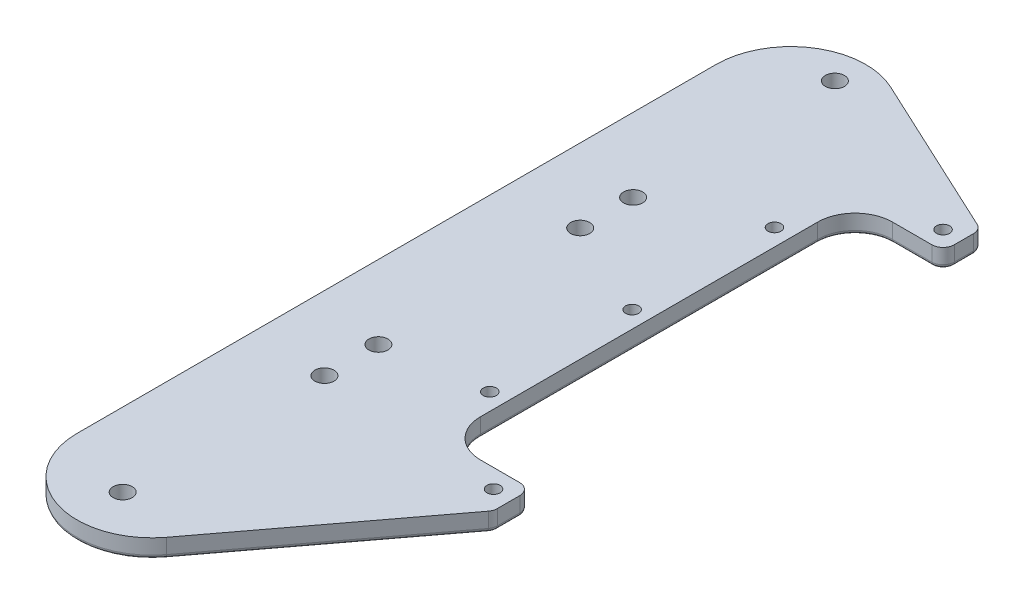
from build123d import *

# Parameters (mm, degrees)
SKETCH1_R               = 1.75
BOSS_EXTRUDE1_DEPTH     = 5
FILLET3_R               = 10
FILLET4_R               = 3
FILLET5_R               = 20
SKETCH2_R               = 4
BOSS_EXTRUDE2_DEPTH     = 5
SKETCH3_R               = 2.55
CUT_EXTRUDE1_DEPTH      = 7
CUT_EXTRUDE2_DEPTH      = 132.108761036
CUT_EXTRUDE2_DEPTH_BACK = 132.108761036
SKETCH4_R               = 1.55
FILLET6_R               = 2
FILLET7_R               = 1
SKETCH6_W               = 1.346153846
SKETCH6_H               = 0.358974359
SKETCH6_W_2             = 0.314102564
SKETCH6_H_2             = 2.557692308
CUT_EXTRUDE3_DEPTH      = 1


with BuildPart() as part:
    # Sketch1 → Boss-Extrude1 (new body)
    with BuildSketch(Plane(origin=(0, 0, 0), x_dir=(1, 0, 0), z_dir=(0, 1, 0))):
        Polygon((28.48, -65), (28.48, -55), (5, -55), (5, 55), (28.48, 55), (28.48, 65), (-45, 99.264286721), (-45, -162.511253493), align=None)
        with Locations(Location((0.48, 0, 0), (0, 0, 270))):
            Circle(SKETCH1_R, mode=Mode.SUBTRACT)
        with Locations(Location((0.48, -38, 0), (0, 0, 270))):
            Circle(SKETCH1_R, mode=Mode.SUBTRACT)
        with Locations(Location((23.48, -60, 0), (0, 0, 270))):
            Circle(SKETCH1_R, mode=Mode.SUBTRACT)
        with Locations(Location((0.48, 38, 0), (0, 0, 270))):
            Circle(SKETCH1_R, mode=Mode.SUBTRACT)
        with Locations(Location((23.48, 60, 0), (0, 0, 270))):
            Circle(SKETCH1_R, mode=Mode.SUBTRACT)
    extrude(amount=BOSS_EXTRUDE1_DEPTH)

    # Fillet3
    fillet3_edges = [part.edges().sort_by_distance(p)[0] for p in [
        (5, 2.5, -55),
        (5, 2.5, 55),
    ]]
    fillet(fillet3_edges, radius=FILLET3_R)

    # Fillet4
    fillet4_edges = [part.edges().sort_by_distance(p)[0] for p in [
        (28.48, 2.5, -65),
        (28.48, 2.5, -55),
        (28.48, 2.5, 55),
        (28.48, 2.5, 65),
    ]]
    fillet(fillet4_edges, radius=FILLET4_R)

    # Fillet5
    fillet5_edges = [part.edges().sort_by_distance(p)[0] for p in [
        (-45, 2.5, 162.511253493),
        (-45, 2.5, -99.264286721),
    ]]
    fillet(fillet5_edges, radius=FILLET5_R)

    # Sketch2 → Boss-Extrude2 (add)
    with BuildSketch(Plane.XZ):
        with Locations(Location((-25.327332377, 41.933648737, 0), (0, 0, 90))):
            Circle(SKETCH2_R)
        with Locations(Location((-25.327332377, -11.933648737, 0), (0, 0, 90))):
            Circle(SKETCH2_R)
        with Locations(Location((-25.327332377, -26.066351263, 0), (0, 0, 90))):
            Circle(SKETCH2_R)
        with Locations(Location((-25.327332377, -79.933648737, 0), (0, 0, 90))):
            Circle(SKETCH2_R)
        with Locations(Location((-25.327332377, 56.343433273, 0), (0, 0, 90))):
            Circle(SKETCH2_R)
        with Locations(Location((-25.327332377, 110.210730748, 0), (0, 0, 90))):
            Circle(SKETCH2_R)
    extrude(amount=BOSS_EXTRUDE2_DEPTH)

    # Sketch3 → Cut-Extrude1 (cut)
    with BuildSketch(Plane(origin=(0, 5, 0), x_dir=(1, 0, 0), z_dir=(0, 1, 0))):
        with Locations(Location((-25.327332377, 79.933648737, 0), (0, 0, 270))):
            Circle(SKETCH3_R)
        with Locations(Location((-25.327332377, 26.066351263, 0), (0, 0, 270))):
            Circle(SKETCH3_R)
        with Locations(Location((-25.327332377, 11.933648737, 0), (0, 0, 270))):
            Circle(SKETCH3_R)
        with Locations(Location((-25.327332377, -41.933648737, 0), (0, 0, 270))):
            Circle(SKETCH3_R)
        with Locations(Location((-25.327332377, -56.343433273, 0), (0, 0, 270))):
            Circle(SKETCH3_R)
        with Locations(Location((-25.327332377, -110.210730748, 0), (0, 0, 270))):
            Circle(SKETCH3_R)
    extrude(amount=-CUT_EXTRUDE1_DEPTH, mode=Mode.SUBTRACT)

    # Sketch4 → Cut-Extrude2 (cut, two sides: drawn at the far end of the back side and taken through both)
    with BuildSketch(Plane.XZ.offset(5).offset(-CUT_EXTRUDE2_DEPTH_BACK)):
        with Locations(Location((-25.327332377, -79.933648737, 0), (0, 0, 90))):
            Circle(SKETCH4_R)
        with Locations(Location((-25.327332377, -26.066351263, 0), (0, 0, 90))):
            Circle(SKETCH4_R)
        with Locations(Location((-25.327332377, -11.933648737, 0), (0, 0, 90))):
            Circle(SKETCH4_R)
        with Locations(Location((-25.327332377, 41.933648737, 0), (0, 0, 90))):
            Circle(SKETCH4_R)
        with Locations(Location((-25.327332377, 56.343433273, 0), (0, 0, 90))):
            Circle(SKETCH4_R)
        with Locations(Location((-25.327332377, 110.210730748, 0), (0, 0, 90))):
            Circle(SKETCH4_R)
    extrude(amount=CUT_EXTRUDE2_DEPTH + CUT_EXTRUDE2_DEPTH_BACK, mode=Mode.SUBTRACT)

    # Fillet6
    fillet6_edges = [part.edges().sort_by_distance(p)[0] for p in [
        (-25.327332377, 0, -30.066351263),
        (-25.327332377, -5, -30.066351263),
        (-25.327332377, 0, -83.933648737),
        (-25.327332377, -5, -83.933648737),
        (-25.327332377, 0, 52.343433273),
        (-25.327332377, -5, 52.343433273),
        (-25.327332377, 0, 106.210730748),
        (-25.327332377, -5, 106.210730748),
        (-25.327332377, 0, 37.933648737),
        (-25.327332377, -5, 37.933648737),
        (-25.327332377, 0, -15.933648737),
        (-25.327332377, -5, -15.933648737),
    ]]
    fillet(fillet6_edges, radius=FILLET6_R)

    # Fillet7
    fillet7_edges = [part.edges().sort_by_distance(p)[0] for p in [
        (5, 0, 0),
        (20.24, 0, -55),
        (7.928932188, 0, 52.071067812),
        (7.928932188, 0, -52.071067812),
        (5.10011001, 0, -75.902221749),
        (28.48, 0, -60.544394609),
        (20.24, 0, 55),
        (28.48, 0, 60.998107021),
        (27.601320344, 0, -55.878679656),
        (27.601320344, 0, 55.878679656),
        (28.324970966, 0, 64.948128011),
        (28.010174337, 0, -64.700688043),
        (9.424308366, 0, 90.287756906),
        (-45, 0, 17.433489529),
        (-35.745992167, 0, -84.738404095),
        (-31.346093128, 0, 121.704027342),
    ]]
    fillet(fillet7_edges, radius=FILLET7_R)

    # Sketch6 → Cut-Extrude3 (cut)
    # profile 1 of 27: a face of its own
    with BuildSketch(Plane(origin=(0, 0, 0), x_dir=(-1, 0, 0), z_dir=(0, -1, 0))):
        with BuildLine():
            Line((37.576923077, 59.5), (38.263321314, 59.5))
            add(Edge.make_bspline(
                [(38.263321314, 59.5), (38.31053222, 59.499948104), (38.400990413, 59.499848668), (38.530705469, 59.496833922), (38.6485152, 59.49280723), (38.754165581, 59.487225337), (38.847981679, 59.480628747), (38.929538979, 59.471376708), (38.999478535, 59.461716412), (39.041384985, 59.451895005), (39.060496795, 59.447415865)],
                knots=[0, 0, 0, 0, 1.415646017, 2.712440637, 3.8905458, 4.950247383, 5.884950622, 6.709939814, 7.411656543, 8, 8, 8, 8], degree=3))
            add(Edge.make_bspline(
                [(39.060496795, 59.447415865), (39.084690329, 59.440793916), (39.132507306, 59.427706054), (39.201408349, 59.40149233), (39.266962194, 59.370410165), (39.329393753, 59.334986225), (39.387935836, 59.293700661), (39.443461877, 59.248227043), (39.495481857, 59.197515475), (39.543703249, 59.142134735), (39.587988047, 59.083014525), (39.626117729, 59.019272295), (39.658044956, 58.951980992), (39.685428228, 58.881187421), (39.705136682, 58.806297097), (39.719983582, 58.727830385), (39.72940721, 58.645795695), (39.730309771, 58.589735827), (39.730769231, 58.561197917)],
                knots=[0, 0, 0, 0, 0.999701418, 1.975846123, 2.934577507, 3.890451536, 4.834027766, 5.787354733, 6.749476667, 7.726910423, 8.712836071, 9.690891519, 10.682875813, 11.679750201, 12.712814741, 13.765529915, 14.8625177, 16, 16, 16, 16], degree=3))
            add(Edge.make_bspline(
                [(39.730769231, 58.561197917), (39.730347806, 58.53242014), (39.72952326, 58.476114476), (39.719626975, 58.393741688), (39.706296783, 58.315023298), (39.685799731, 58.240133847), (39.658954058, 58.169518077), (39.627462005, 58.102096845), (39.589478475, 58.039017173), (39.545833645, 57.980050055), (39.49728205, 57.925140143), (39.444029112, 57.874685348), (39.38628982, 57.82898101), (39.324247672, 57.787924666), (39.257297823, 57.752468387), (39.186455669, 57.720711082), (39.111105453, 57.694040021), (39.058962939, 57.68000996), (39.032451923, 57.672876603)],
                knots=[0, 0, 0, 0, 1.121902311, 2.195077645, 3.232258892, 4.234102512, 5.217864754, 6.176164875, 7.132989551, 8.084763148, 9.034132444, 9.988522005, 10.94243251, 11.903244335, 12.886203696, 13.894208494, 14.929344452, 16, 16, 16, 16], degree=3))
            add(Edge.make_bspline(
                [(39.032451923, 57.672876603), (39.010524589, 57.668213621), (38.962469562, 57.657994427), (38.88332684, 57.64658597), (38.791181454, 57.63684837), (38.686159174, 57.629547232), (38.568354269, 57.623296864), (38.437703011, 57.61832877), (38.293948934, 57.615598916), (38.19367769, 57.615458123), (38.141326122, 57.615384615)],
                knots=[0, 0, 0, 0, 0.601384939, 1.31797006, 2.144135048, 3.087295005, 4.142315834, 5.309527816, 6.595305764, 8, 8, 8, 8], degree=3))
            Line((38.141326122, 57.615384615), (37.891025641, 57.615384615))
            Line((37.891025641, 57.615384615), (37.891025641, 56))
            Line((37.891025641, 56), (37.576923077, 56))
            Line((37.576923077, 56), (37.576923077, 59.5))
        make_face()
        with BuildLine():
            Line((37.891025641, 59.141025641), (37.891025641, 57.974358974))
            Line((37.891025641, 57.974358974), (38.50380609, 57.966646635))
            add(Edge.make_bspline(
                [(38.50380609, 57.966646635), (38.533726016, 57.966631171), (38.591485815, 57.966601319), (38.674922039, 57.970586542), (38.752331326, 57.975187075), (38.823475901, 57.981922998), (38.888387836, 57.991444256), (38.947175365, 58.001055994), (38.999382648, 58.014961356), (39.060481849, 58.033684426), (39.128565197, 58.065617041), (39.202632745, 58.111966931), (39.265403332, 58.17104764), (39.319721629, 58.237475471), (39.362827506, 58.3113746), (39.394383499, 58.390443537), (39.412924656, 58.473871387), (39.41541085, 58.530959525), (39.416666667, 58.559795673)],
                knots=[0, 0, 0, 0, 1.160613943, 2.240541288, 3.23993089, 4.169200891, 5.011653406, 5.7853311, 6.478053781, 7.106038997, 8.262395093, 9.384106736, 10.481365981, 11.59014053, 12.70357646, 13.786202915, 14.881775077, 16, 16, 16, 16], degree=3))
            add(Edge.make_bspline(
                [(39.416666667, 58.559795673), (39.41540402, 58.587934187), (39.412894035, 58.643870069), (39.394238172, 58.725848829), (39.362888858, 58.804084534), (39.319432264, 58.877057619), (39.266691134, 58.943246423), (39.205391791, 59.00074355), (39.135678529, 59.046965253), (39.070830298, 59.076798534), (39.013229112, 59.09501381), (38.963197152, 59.10775865), (38.906706478, 59.117934257), (38.843738698, 59.126173759), (38.774781864, 59.133227221), (38.69924355, 59.138013198), (38.617409906, 59.140814654), (38.560599335, 59.140953609), (38.53114984, 59.141025641)],
                knots=[0, 0, 0, 0, 1.120700087, 2.227813068, 3.331159281, 4.466773991, 5.599788987, 6.693661531, 7.80175334, 8.91857717, 9.525282508, 10.207424825, 10.974604443, 11.810962634, 12.737642355, 13.736264703, 14.826523623, 16, 16, 16, 16], degree=3))
            Line((38.53114984, 59.141025641), (37.891025641, 59.141025641))
        make_face(mode=Mode.SUBTRACT)
    # profile 2 of 27: a face of its own
    with BuildSketch(Plane(origin=(0, 0, 0), x_dir=(-1, 0, 0), z_dir=(0, -1, 0))):
        with BuildLine():
            Line((34.435897436, 59.5), (34.75, 59.5))
            Line((34.75, 59.5), (34.75, 57.402944712))
            add(Edge.make_bspline(
                [(34.75, 57.402944712), (34.749953256, 57.373263976), (34.749864551, 57.316939665), (34.750457065, 57.236771364), (34.752116434, 57.165498905), (34.753162593, 57.102847558), (34.755489927, 57.04910481), (34.757387974, 57.0039795), (34.75982853, 56.967685297), (34.762761648, 56.946504371), (34.764022436, 56.93739984)],
                knots=[0, 0, 0, 0, 1.528628734, 2.90083645, 4.128790002, 5.200304208, 6.127813768, 6.898992206, 7.526736466, 8, 8, 8, 8], degree=3))
            add(Edge.make_bspline(
                [(34.764022436, 56.93739984), (34.769199895, 56.904553076), (34.779263081, 56.840710347), (34.804909459, 56.749802065), (34.84072696, 56.667870607), (34.883170003, 56.592359316), (34.939102614, 56.525369956), (35.006106149, 56.463658303), (35.087283918, 56.409686499), (35.177544523, 56.360335687), (35.274829761, 56.320670604), (35.374241027, 56.29067724), (35.474284006, 56.27239834), (35.541260171, 56.270281801), (35.574519231, 56.269230769)],
                knots=[0, 0, 0, 0, 1.035780045, 2.013197591, 2.933192213, 3.817615948, 4.702609284, 5.640816605, 6.646850145, 7.73207398, 8.84249596, 9.914020372, 10.964143139, 12, 12, 12, 12], degree=3))
            add(Edge.make_bspline(
                [(35.574519231, 56.269230769), (35.603072971, 56.27030462), (35.660015533, 56.272446118), (35.744621964, 56.285707549), (35.827022072, 56.309608115), (35.907622752, 56.340447873), (35.983173737, 56.381195464), (36.053717179, 56.428266303), (36.116681113, 56.48347718), (36.174139111, 56.544577524), (36.224174047, 56.613517324), (36.267545188, 56.688795462), (36.303071118, 56.771544809), (36.320614643, 56.829699231), (36.329627404, 56.859575321)],
                knots=[0, 0, 0, 0, 0.994687771, 1.983630487, 2.973142513, 3.978332533, 4.983357753, 5.956394766, 6.925816176, 7.893390482, 8.871859704, 9.88551698, 10.913711441, 12, 12, 12, 12], degree=3))
            add(Edge.make_bspline(
                [(36.329627404, 56.859575321), (36.332627529, 56.871923895), (36.339313017, 56.899441495), (36.345560062, 56.945962785), (36.352066588, 57.000852149), (36.356581158, 57.064503962), (36.360982378, 57.136704935), (36.363615451, 57.217831192), (36.364832484, 57.307588153), (36.365195164, 57.370225315), (36.365384615, 57.402944712)],
                knots=[0, 0, 0, 0, 0.558680831, 1.244966039, 2.062412453, 2.990489873, 4.051219941, 5.244515665, 6.560634259, 8, 8, 8, 8], degree=3))
            Line((36.365384615, 57.402944712), (36.365384615, 59.5))
            Line((36.365384615, 59.5), (36.679487179, 59.5))
            Line((36.679487179, 59.5), (36.679487179, 57.386117788))
            add(Edge.make_bspline(
                [(36.679487179, 57.386117788), (36.679233059, 57.34801941), (36.678737128, 57.273668107), (36.674436551, 57.164716748), (36.667579551, 57.061363766), (36.657891463, 56.96359527), (36.64505446, 56.871761111), (36.63077924, 56.785056342), (36.612599707, 56.70410335), (36.591366305, 56.628270932), (36.567092757, 56.556085419), (36.535651609, 56.487576804), (36.500227109, 56.420662404), (36.458212456, 56.356354295), (36.411001074, 56.294367742), (36.357549393, 56.235078667), (36.299625232, 56.177539621), (36.236265672, 56.123226555), (36.168515147, 56.073417878), (36.096575189, 56.029620107), (36.02099842, 55.992596489), (35.941981294, 55.962120565), (35.859490091, 55.939205966), (35.773522731, 55.92213081), (35.683883538, 55.912428513), (35.622918881, 55.910986582), (35.592047276, 55.91025641)],
                knots=[0, 0, 0, 0, 1.316592851, 2.569410997, 3.76748051, 4.895814652, 5.963796859, 6.97159953, 7.931736103, 8.829262218, 9.692595152, 10.560224239, 11.431080259, 12.30701507, 13.211635791, 14.121146779, 15.063487852, 16.031507147, 17.00238618, 17.966455255, 18.938106653, 19.907068911, 20.888905087, 21.893141452, 22.933117798, 24, 24, 24, 24], degree=3))
            add(Edge.make_bspline(
                [(35.592047276, 55.91025641), (35.558378173, 55.911041176), (35.492319514, 55.912580882), (35.394981447, 55.921403632), (35.301667251, 55.938022027), (35.211391374, 55.95918197), (35.125382876, 55.988365708), (35.042489432, 56.022463832), (34.964130751, 56.064341093), (34.889035622, 56.110934486), (34.819210866, 56.163359124), (34.755113463, 56.220499298), (34.696637592, 56.281439675), (34.644768896, 56.346840041), (34.598648012, 56.416191748), (34.558917798, 56.489690988), (34.524804554, 56.567309304), (34.507197987, 56.621262504), (34.498297276, 56.64853766)],
                knots=[0, 0, 0, 0, 1.13879206, 2.234305948, 3.301075583, 4.341971843, 5.366689343, 6.369221514, 7.369726634, 8.367512178, 9.355451585, 10.318319045, 11.268648973, 12.207971039, 13.137398894, 14.081662264, 15.030215811, 16, 16, 16, 16], degree=3))
            add(Edge.make_bspline(
                [(34.498297276, 56.64853766), (34.493120117, 56.667170235), (34.481890746, 56.707584704), (34.469865448, 56.774471192), (34.459756367, 56.85148611), (34.450250809, 56.938634728), (34.444641851, 57.035984595), (34.439724412, 57.143493511), (34.435862793, 57.261291472), (34.435885566, 57.343345988), (34.435897436, 57.386117788)],
                knots=[0, 0, 0, 0, 0.625038921, 1.35572334, 2.194682327, 3.136881307, 4.189498639, 5.346923369, 6.617055217, 8, 8, 8, 8], degree=3))
            Line((34.435897436, 57.386117788), (34.435897436, 59.5))
        make_face()
    # profile 3 of 27: a face of its own
    with BuildSketch(Plane(origin=(0, 0, 0), x_dir=(-1, 0, 0), z_dir=(0, -1, 0))):
        Polygon((32.237179487, 59.5), (32.506410256, 59.5), (33.673076923, 56.852564103), (33.334435096, 56.852564103), (32.371794872, 59.036558494), (31.409154647, 56.852564103), (31.070512821, 56.852564103), align=None)
    # profile 4 of 27: a face of its own
    with BuildSketch(Plane(origin=(0, 0, 0), x_dir=(-1, 0, 0), z_dir=(0, -1, 0))):
        with BuildLine():
            Line((37.891025641, 51.58974359), (37.576923077, 51.58974359))
            add(Edge.make_bspline(
                [(37.576923077, 51.58974359), (37.57897023, 51.631414478), (37.582990784, 51.713254992), (37.601819073, 51.832578898), (37.62875995, 51.946633697), (37.666851404, 52.054503611), (37.714157682, 52.157142418), (37.77088771, 52.254142434), (37.83808156, 52.345133623), (37.914288294, 52.429272466), (37.997056933, 52.506460037), (38.086362873, 52.57311528), (38.1802079, 52.629432951), (38.278307299, 52.676514193), (38.381767862, 52.711854039), (38.48965072, 52.738075678), (38.602429857, 52.753852024), (38.679269879, 52.75554781), (38.718349359, 52.756410256)],
                knots=[0, 0, 0, 0, 1.10065271, 2.161652631, 3.183658789, 4.190468796, 5.17591951, 6.163126047, 7.15150782, 8.156236427, 9.156009102, 10.134482811, 11.092018607, 12.041330605, 13.001268258, 13.972401359, 14.968799086, 16, 16, 16, 16], degree=3))
            add(Edge.make_bspline(
                [(38.718349359, 52.756410256), (38.756727433, 52.7555118), (38.832138978, 52.753746365), (38.942200992, 52.738585336), (39.046978287, 52.714839744), (39.146266053, 52.681524328), (39.239272118, 52.636739901), (39.326695162, 52.582942362), (39.409575973, 52.520722531), (39.484182757, 52.447468717), (39.552690836, 52.369266333), (39.611793091, 52.285778429), (39.662406255, 52.199549143), (39.704593934, 52.109920942), (39.735650073, 52.016049913), (39.759228281, 51.91930271), (39.772555695, 51.818677899), (39.774601119, 51.750571344), (39.775641026, 51.715945513)],
                knots=[0, 0, 0, 0, 1.111607364, 2.184268762, 3.212621178, 4.221274766, 5.211760367, 6.196651075, 7.1921475, 8.207485113, 9.220403448, 10.201281604, 11.166441695, 12.114753415, 13.065576456, 14.026450734, 14.996634279, 16, 16, 16, 16], degree=3))
            add(Edge.make_bspline(
                [(39.775641026, 51.715945513), (39.773947763, 51.667197678), (39.770590951, 51.570557465), (39.741876575, 51.428542602), (39.697030064, 51.290949183), (39.643032707, 51.180211881), (39.588560263, 51.090978387), (39.539472755, 51.017509682), (39.482007944, 50.938404214), (39.415329446, 50.853926876), (39.340816574, 50.763415971), (39.257794411, 50.666926176), (39.165670929, 50.565454406), (39.101012428, 50.496148805), (39.067508013, 50.460236378)],
                knots=[0, 0, 0, 0, 1.184426356, 2.348067706, 3.509069118, 4.696110526, 5.333549288, 6.050745305, 6.844228056, 7.710549037, 8.667450064, 9.695053472, 10.805634456, 12, 12, 12, 12], degree=3))
            Line((39.067508013, 50.460236378), (38.191806891, 49.525641026))
            Line((38.191806891, 49.525641026), (39.820512821, 49.525641026))
            Line((39.820512821, 49.525641026), (39.820512821, 49.166666667))
            Line((39.820512821, 49.166666667), (37.442307692, 49.166666667))
            Line((37.442307692, 49.166666667), (38.799679487, 50.615184295))
            add(Edge.make_bspline(
                [(38.799679487, 50.615184295), (38.832727374, 50.649682601), (38.896205601, 50.715946788), (38.985988178, 50.812689748), (39.066627166, 50.902439289), (39.138644559, 50.985025837), (39.200478064, 51.061657405), (39.255350296, 51.129852109), (39.299315887, 51.192606559), (39.347031283, 51.265347173), (39.393245264, 51.35415949), (39.43295762, 51.462693179), (39.457172469, 51.574420432), (39.460077304, 51.649922469), (39.461538462, 51.687900641)],
                knots=[0, 0, 0, 0, 1.329631726, 2.553950428, 3.673215718, 4.687767853, 5.603093632, 6.413772471, 7.123043292, 7.734684054, 8.834405432, 9.900288307, 10.943827018, 12, 12, 12, 12], degree=3))
            add(Edge.make_bspline(
                [(39.461538462, 51.687900641), (39.460902719, 51.711782039), (39.459649793, 51.75884769), (39.448592096, 51.827853449), (39.43188159, 51.894418263), (39.407936332, 51.958746882), (39.376329592, 52.020192534), (39.337856212, 52.078830014), (39.293466148, 52.135518979), (39.242114879, 52.188672277), (39.185703359, 52.237353483), (39.126109109, 52.280477568), (39.063059005, 52.316516679), (38.996818883, 52.346060176), (38.927573414, 52.369235557), (38.855188669, 52.385294137), (38.779864652, 52.395376621), (38.728431157, 52.396740793), (38.702223558, 52.397435897)],
                knots=[0, 0, 0, 0, 0.991446411, 1.95395049, 2.89581595, 3.838931463, 4.798493298, 5.75982156, 6.748411868, 7.785213223, 8.824556874, 9.840280684, 10.836137867, 11.835679398, 12.848801643, 13.863922112, 14.911575587, 16, 16, 16, 16], degree=3))
            add(Edge.make_bspline(
                [(38.702223558, 52.397435897), (38.674852725, 52.396720865), (38.621100929, 52.39531666), (38.542181896, 52.385493996), (38.466896118, 52.368548155), (38.395054215, 52.345371481), (38.326534629, 52.315912932), (38.261670585, 52.279221188), (38.200607696, 52.235437694), (38.143231173, 52.185797138), (38.090367194, 52.130529537), (38.043920318, 52.068919574), (38.003336304, 52.002092158), (37.96792707, 51.930227608), (37.93917138, 51.852673828), (37.91719823, 51.769706123), (37.899811383, 51.681684742), (37.894002862, 51.620899657), (37.891025641, 51.58974359)],
                knots=[0, 0, 0, 0, 1.031018746, 2.02475058, 2.990194455, 3.934040569, 4.864654155, 5.795059489, 6.735614925, 7.690564532, 8.649604399, 9.611025574, 10.590972636, 11.591080095, 12.624614302, 13.701020113, 14.821632451, 16, 16, 16, 16], degree=3))
        make_face()
    # profile 5 of 27: a face of its own
    with BuildSketch(Plane(origin=(0, 0, 0), x_dir=(-1, 0, 0), z_dir=(0, -1, 0))):
        Polygon((34.121794872, 52.666666667), (34.458333333, 52.666666667), (35.625, 49.908453526), (36.791666667, 52.666666667), (37.128205128, 52.666666667), (35.647435897, 49.166666667), (35.602564103, 49.166666667), align=None)
    # profile 6 of 27: a face of its own
    with BuildSketch(Plane(origin=(0, 0, 0), x_dir=(-1, 0, 0), z_dir=(0, -1, 0))):
        Polygon((31.653846154, 52.756410256), (31.967948718, 52.756410256), (31.967948718, 51.724358974), (32.416666667, 51.724358974), (32.416666667, 51.41025641), (31.967948718, 51.41025641), (31.967948718, 49.166666667), (31.653846154, 49.166666667), (31.653846154, 51.41025641), (31.205128205, 51.41025641), (31.205128205, 51.724358974), (31.653846154, 51.724358974), align=None)
    # profile 7 of 27: a face of its own
    with BuildSketch(Plane(origin=(0, 0, 0), x_dir=(-1, 0, 0), z_dir=(0, -1, 0))):
        with BuildLine():
            Line((28.378205128, 51.724358974), (28.692307692, 51.724358974))
            Line((28.692307692, 51.724358974), (28.692307692, 51.263020833))
            add(Edge.make_bspline(
                [(28.692307692, 51.263020833), (28.725845327, 51.304863556), (28.790926278, 51.38606082), (28.899310612, 51.492781394), (29.013854512, 51.580726619), (29.133856516, 51.650830413), (29.259479526, 51.703677039), (29.389957796, 51.74184297), (29.526072502, 51.764727799), (29.618636939, 51.767718029), (29.665464744, 51.769230769)],
                knots=[0, 0, 0, 0, 1.12780773, 2.188550248, 3.19190651, 4.159438251, 5.104880172, 6.052711206, 7.014878035, 8, 8, 8, 8], degree=3))
            add(Edge.make_bspline(
                [(29.665464744, 51.769230769), (29.712795378, 51.767485574), (29.805432845, 51.764069805), (29.940310907, 51.737053114), (30.066284301, 51.690907859), (30.182903856, 51.627695789), (30.28803107, 51.549089315), (30.380355921, 51.457511534), (30.456719169, 51.35217545), (30.507916532, 51.254452294), (30.541642179, 51.1677635), (30.562874517, 51.09351675), (30.580905498, 51.010798599), (30.596537246, 50.919859009), (30.607114358, 50.820060819), (30.61545665, 50.711813127), (30.621435344, 50.595150997), (30.621672551, 50.514464369), (30.621794872, 50.472856571)],
                knots=[0, 0, 0, 0, 1.235846778, 2.418850247, 3.575807741, 4.728682307, 5.871620074, 6.994088408, 8.11269785, 9.256955736, 9.865816715, 10.540099792, 11.271859618, 12.076849838, 12.949306005, 13.892391288, 14.913166135, 16, 16, 16, 16], degree=3))
            Line((30.621794872, 50.472856571), (30.621794872, 49.166666667))
            Line((30.621794872, 49.166666667), (30.307692308, 49.166666667))
            Line((30.307692308, 49.166666667), (30.307692308, 50.369791667))
            add(Edge.make_bspline(
                [(30.307692308, 50.369791667), (30.3074991, 50.404614112), (30.307129526, 50.471223522), (30.305963879, 50.566592546), (30.303154072, 50.653079124), (30.299205759, 50.730476491), (30.293426729, 50.798710328), (30.287404098, 50.857919605), (30.280039121, 50.908029147), (30.273476208, 50.938194229), (30.270532853, 50.951722756)],
                knots=[0, 0, 0, 0, 1.430800155, 2.736877192, 3.918605307, 4.986035426, 5.920637409, 6.731861385, 7.431261377, 8, 8, 8, 8], degree=3))
            add(Edge.make_bspline(
                [(30.270532853, 50.951722756), (30.259907321, 50.991433941), (30.23945646, 51.067865686), (30.188922477, 51.171540039), (30.125108296, 51.259738226), (30.047210447, 51.331914948), (29.955981371, 51.388085785), (29.851674229, 51.427059739), (29.735295588, 51.451436009), (29.653441205, 51.453863141), (29.610777244, 51.455128205)],
                knots=[0, 0, 0, 0, 1.084156227, 2.086665306, 3.027808233, 3.945421172, 4.874247719, 5.839848303, 6.874090471, 8, 8, 8, 8], degree=3))
            add(Edge.make_bspline(
                [(29.610777244, 51.455128205), (29.58550956, 51.4546522), (29.535505467, 51.4537102), (29.461355495, 51.444258902), (29.389431322, 51.428800446), (29.319011113, 51.407931808), (29.251503319, 51.379269539), (29.184739028, 51.346740169), (29.121232264, 51.306191957), (29.059628867, 51.261001336), (29.002316059, 51.210922128), (28.948987721, 51.158077618), (28.9014497, 51.101802014), (28.858381025, 51.043002067), (28.821202762, 50.980870229), (28.788749674, 50.916005922), (28.761213979, 50.848323774), (28.747531286, 50.801348712), (28.740685096, 50.777844551)],
                knots=[0, 0, 0, 0, 1.023777757, 2.026029729, 3.023749952, 4.003683103, 4.997618607, 5.993177895, 7.010360494, 8.046726602, 9.087585522, 10.09234134, 11.086953743, 12.070360549, 13.043493632, 14.017870808, 15.008233677, 16, 16, 16, 16], degree=3))
            add(Edge.make_bspline(
                [(28.740685096, 50.777844551), (28.736745448, 50.760589348), (28.728169039, 50.723025674), (28.718905859, 50.661381254), (28.710498283, 50.590071279), (28.703461325, 50.509178962), (28.699155908, 50.418421087), (28.694461512, 50.318185249), (28.692752451, 50.208071761), (28.692460097, 50.131410068), (28.692307692, 50.091446314)],
                knots=[0, 0, 0, 0, 0.615963638, 1.340920617, 2.168419149, 3.115676021, 4.16674242, 5.331190069, 6.6087489, 8, 8, 8, 8], degree=3))
            Line((28.692307692, 50.091446314), (28.692307692, 49.166666667))
            Line((28.692307692, 49.166666667), (28.378205128, 49.166666667))
            Line((28.378205128, 49.166666667), (28.378205128, 51.724358974))
        make_face()
    # profile 8 of 27: a face of its own
    with BuildSketch(Plane(origin=(0, 0, 0), x_dir=(-1, 0, 0), z_dir=(0, -1, 0))):
        with BuildLine():
            Line((25.371794872, 51.724358974), (25.685897436, 51.724358974))
            Line((25.685897436, 51.724358974), (25.685897436, 50.538060897))
            add(Edge.make_bspline(
                [(25.685897436, 50.538060897), (25.686039341, 50.503238148), (25.686310798, 50.43662386), (25.688151739, 50.340768673), (25.692481833, 50.253351961), (25.697895657, 50.174323224), (25.704857793, 50.103695832), (25.713141154, 50.041716475), (25.722399576, 49.987682291), (25.73146229, 49.955138936), (25.735677083, 49.940004006)],
                knots=[0, 0, 0, 0, 1.388932606, 2.656963016, 3.823490214, 4.879454478, 5.816252168, 6.653371382, 7.373723809, 8, 8, 8, 8], degree=3))
            add(Edge.make_bspline(
                [(25.735677083, 49.940004006), (25.742438538, 49.920981135), (25.755820879, 49.883330874), (25.780094363, 49.828941869), (25.8101227, 49.778566587), (25.842982528, 49.730262514), (25.880881935, 49.685460527), (25.923341406, 49.644236283), (25.968939643, 49.605032192), (26.036694667, 49.5586474), (26.129353933, 49.50893207), (26.251006688, 49.466036252), (26.382910914, 49.440400432), (26.474075633, 49.437426177), (26.520933494, 49.435897436)],
                knots=[0, 0, 0, 0, 0.725840625, 1.436591201, 2.137033971, 2.831655856, 3.53531722, 4.242432219, 4.957935707, 5.694543706, 7.190802206, 8.724350549, 10.316345118, 12, 12, 12, 12], degree=3))
            add(Edge.make_bspline(
                [(26.520933494, 49.435897436), (26.567787001, 49.437458684), (26.65843987, 49.440479412), (26.788894839, 49.46526295), (26.908146253, 49.506668639), (27.014997205, 49.564476051), (27.108963045, 49.635218114), (27.187267464, 49.718226923), (27.251874718, 49.810876309), (27.280084139, 49.880000588), (27.294270833, 49.914763622)],
                knots=[0, 0, 0, 0, 1.157059328, 2.238695713, 3.266970494, 4.264342957, 5.228770407, 6.160125903, 7.074715775, 8, 8, 8, 8], degree=3))
            add(Edge.make_bspline(
                [(27.294270833, 49.914763622), (27.298465063, 49.92872992), (27.307737482, 49.959605996), (27.317699833, 50.011985744), (27.326674295, 50.074450349), (27.334337471, 50.147408557), (27.339802634, 50.23066971), (27.34274866, 50.324207786), (27.346076935, 50.427729146), (27.346127452, 50.500196906), (27.346153846, 50.538060897)],
                knots=[0, 0, 0, 0, 0.557542046, 1.232589297, 2.036731608, 2.971723315, 4.038036528, 5.22795436, 6.551621927, 8, 8, 8, 8], degree=3))
            Line((27.346153846, 50.538060897), (27.346153846, 51.724358974))
            Line((27.346153846, 51.724358974), (27.66025641, 51.724358974))
            Line((27.66025641, 51.724358974), (27.66025641, 50.479166667))
            add(Edge.make_bspline(
                [(27.66025641, 50.479166667), (27.659814715, 50.436859495), (27.658957767, 50.354777795), (27.653450424, 50.235493684), (27.644000811, 50.124331439), (27.629658126, 50.021232219), (27.612792451, 49.926274737), (27.591036178, 49.839337291), (27.565057941, 49.760687737), (27.535752426, 49.688945961), (27.501130558, 49.623899066), (27.464303538, 49.56216325), (27.421778766, 49.505270315), (27.377008532, 49.450388177), (27.327206876, 49.40024665), (27.273307017, 49.353695174), (27.216067597, 49.310022142), (27.154218399, 49.270930863), (27.088662336, 49.235714218), (27.019318479, 49.204498139), (26.945337481, 49.179795562), (26.867673844, 49.158484897), (26.785947064, 49.141770428), (26.700235931, 49.129983861), (26.610569315, 49.12275853), (26.549459855, 49.122121485), (26.518129006, 49.121794872)],
                knots=[0, 0, 0, 0, 1.493040784, 2.896703357, 4.213163133, 5.428574705, 6.569057535, 7.615249723, 8.588095153, 9.490268104, 10.346124644, 11.18633936, 12.024365274, 12.850166724, 13.684164916, 14.514361689, 15.362232829, 16.222528818, 17.093394965, 17.986930858, 18.902426812, 19.842810585, 20.827885679, 21.843828298, 22.894529745, 24, 24, 24, 24], degree=3))
            add(Edge.make_bspline(
                [(26.518129006, 49.121794872), (26.487032492, 49.122134579), (26.425924947, 49.122802135), (26.336253703, 49.129943943), (26.250305097, 49.141752113), (26.168384698, 49.158607331), (26.090410301, 49.179646401), (26.016066061, 49.204649936), (25.946222498, 49.235730418), (25.880040494, 49.270707975), (25.818038106, 49.310273251), (25.759929528, 49.353641291), (25.705792675, 49.400747354), (25.655615607, 49.451394711), (25.610102631, 49.506211647), (25.568686589, 49.564757207), (25.530729884, 49.626451296), (25.496377093, 49.692514458), (25.466865338, 49.765086468), (25.440810092, 49.845383565), (25.419499454, 49.934286082), (25.402156985, 50.031718011), (25.388205545, 50.137213052), (25.378519402, 50.251381467), (25.373103572, 50.37394516), (25.37224051, 50.45859505), (25.371794872, 50.502303686)],
                knots=[0, 0, 0, 0, 1.083640291, 2.129454052, 3.13281866, 4.105697902, 5.042300162, 5.946461698, 6.836384745, 7.703652036, 8.553297018, 9.397182691, 10.228592656, 11.052265423, 11.879314572, 12.708807002, 13.549817954, 14.402308542, 15.300838682, 16.27712199, 17.341985831, 18.484375296, 19.725102775, 21.0496083, 22.476576903, 24, 24, 24, 24], degree=3))
            Line((25.371794872, 50.502303686), (25.371794872, 51.724358974))
        make_face()
    # profile 9 of 27: a face of its own
    with BuildSketch(Plane(origin=(0, 0, 0), x_dir=(-1, 0, 0), z_dir=(0, -1, 0))):
        with BuildLine():
            add(Edge.make_bspline(
                [(23.466145833, 51.769230769), (23.514137106, 51.768208878), (23.608236264, 51.766205199), (23.74604415, 51.744790234), (23.877589286, 51.712042869), (24.003375478, 51.666771307), (24.121791773, 51.606089357), (24.234563017, 51.533680066), (24.341380026, 51.447897472), (24.405403055, 51.381539404), (24.437900641, 51.347856571)],
                knots=[0, 0, 0, 0, 1.054011418, 2.066658804, 3.057071809, 4.030435133, 4.997543892, 5.974964718, 6.972108034, 8, 8, 8, 8], degree=3))
            add(Edge.make_bspline(
                [(24.437900641, 51.347856571), (24.465882595, 51.315642585), (24.521304975, 51.251838043), (24.592370694, 51.14838243), (24.653592254, 51.041242329), (24.702655215, 50.928995002), (24.741340239, 50.812620331), (24.768805935, 50.69171832), (24.78514287, 50.566555973), (24.787345837, 50.481552135), (24.788461538, 50.438501603)],
                knots=[0, 0, 0, 0, 1.025258237, 2.030674902, 3.01204498, 3.988269485, 4.97094183, 5.956517959, 6.965070386, 8, 8, 8, 8], degree=3))
            add(Edge.make_bspline(
                [(24.788461538, 50.438501603), (24.787480201, 50.395201545), (24.785541033, 50.309638612), (24.767197416, 50.183619246), (24.738666331, 50.061424423), (24.697834492, 49.943565729), (24.645476383, 49.829682902), (24.581585696, 49.720273353), (24.505714078, 49.615121219), (24.419710082, 49.515119381), (24.324658206, 49.422953166), (24.221542057, 49.342624897), (24.112388023, 49.273803372), (23.99574467, 49.218366957), (23.872677183, 49.174657256), (23.742920115, 49.14395724), (23.606675045, 49.125395556), (23.513647824, 49.123011983), (23.466145833, 49.121794872)],
                knots=[0, 0, 0, 0, 0.998656419, 1.973391657, 2.932242238, 3.890759089, 4.846373663, 5.82037756, 6.809684879, 7.83454468, 8.860553229, 9.859544525, 10.845671541, 11.83227036, 12.833544569, 13.85385346, 14.904124723, 16, 16, 16, 16], degree=3))
            add(Edge.make_bspline(
                [(23.466145833, 49.121794872), (23.418411114, 49.123016068), (23.324920254, 49.125407843), (23.188194272, 49.143885125), (23.058204653, 49.174643108), (22.934976055, 49.218510601), (22.817831208, 49.273805144), (22.708044711, 49.342416834), (22.604844795, 49.422976989), (22.509772811, 49.515112926), (22.423774206, 49.615122882), (22.347901197, 49.720272921), (22.284010871, 49.829683014), (22.231652667, 49.943565699), (22.190820854, 50.061424431), (22.162289762, 50.183619244), (22.143946147, 50.309638612), (22.142006978, 50.395201545), (22.141025641, 50.438501603)],
                knots=[0, 0, 0, 0, 1.099876186, 2.154163076, 3.173186993, 4.173200201, 5.163417411, 6.152872554, 7.150605724, 8.17532212, 9.198891216, 10.186952605, 11.159729845, 12.11414092, 13.071450619, 14.029093627, 15.002601286, 16, 16, 16, 16], degree=3))
            add(Edge.make_bspline(
                [(22.141025641, 50.438501603), (22.142148951, 50.481318148), (22.144372913, 50.566087551), (22.160693422, 50.691014612), (22.188051978, 50.811712001), (22.226783375, 50.927637477), (22.276298566, 51.039392913), (22.336659854, 51.146797744), (22.408450486, 51.249785544), (22.463652438, 51.313507624), (22.491586538, 51.345753205)],
                knots=[0, 0, 0, 0, 1.031353054, 2.041901799, 3.029428768, 4.008703097, 4.981709435, 5.96992636, 6.972712378, 8, 8, 8, 8], degree=3))
            add(Edge.make_bspline(
                [(22.491586538, 51.345753205), (22.524035129, 51.379728144), (22.587850993, 51.446545841), (22.695199721, 51.532078365), (22.807693542, 51.605994439), (22.927418468, 51.665470654), (23.053101326, 51.712309172), (23.185320569, 51.744874687), (23.323596084, 51.766128042), (23.418155705, 51.76818622), (23.466145833, 51.769230769)],
                knots=[0, 0, 0, 0, 1.027980169, 2.021703884, 2.998553061, 3.971491411, 4.943284454, 5.930300938, 6.949603206, 8, 8, 8, 8], degree=3))
        make_face()
        with BuildLine():
            add(Edge.make_bspline(
                [(23.46474359, 51.455128205), (23.430805978, 51.454163613), (23.36380685, 51.452259331), (23.265187265, 51.437775426), (23.170247111, 51.414827922), (23.078806267, 51.382223866), (22.991173095, 51.340124967), (22.907263692, 51.288416607), (22.826831252, 51.22778365), (22.751449189, 51.158320979), (22.682266877, 51.082441984), (22.6217889, 51.001593625), (22.570363794, 50.917087279), (22.527523635, 50.828835068), (22.495616447, 50.735942654), (22.472443424, 50.639462023), (22.457973184, 50.539196606), (22.456086805, 50.471035588), (22.455128205, 50.436398237)],
                knots=[0, 0, 0, 0, 1.021534396, 2.016698045, 2.994645724, 3.958388632, 4.93408049, 5.916473867, 6.921342795, 7.962252576, 8.998418191, 10.008913653, 10.997312074, 11.973003931, 12.956656626, 13.948281152, 14.957379055, 16, 16, 16, 16], degree=3))
            add(Edge.make_bspline(
                [(22.455128205, 50.436398237), (22.456735029, 50.39164621), (22.459924273, 50.302821805), (22.48585951, 50.172010682), (22.52924579, 50.04642883), (22.587833069, 49.926812444), (22.661239288, 49.816140166), (22.747726355, 49.717468681), (22.846366055, 49.63228287), (22.955982555, 49.561602024), (23.074336873, 49.505442269), (23.199593194, 49.465643293), (23.330233888, 49.4397716), (23.419514619, 49.437200126), (23.46474359, 49.435897436)],
                knots=[0, 0, 0, 0, 1.016792936, 2.018143844, 3.017858371, 4.030088057, 5.03801393, 6.028138512, 7.003788237, 7.991172063, 8.984598303, 9.972568034, 10.972917682, 12, 12, 12, 12], degree=3))
            add(Edge.make_bspline(
                [(23.46474359, 49.435897436), (23.509969959, 49.437207716), (23.599245555, 49.439794173), (23.729704731, 49.465512993), (23.854618703, 49.505616653), (23.972850091, 49.561538863), (24.082416694, 49.632551278), (24.181765816, 49.716987655), (24.267514427, 49.816401507), (24.340848032, 49.926959035), (24.400394774, 50.046243387), (24.443577976, 50.17203386), (24.469575562, 50.302815902), (24.472756391, 50.391644232), (24.474358974, 50.436398237)],
                knots=[0, 0, 0, 0, 1.02726834, 2.027799167, 3.010890988, 4.004497153, 4.992059811, 5.971914811, 6.958719428, 7.966827853, 8.981595046, 9.981490638, 10.983022906, 12, 12, 12, 12], degree=3))
            add(Edge.make_bspline(
                [(24.474358974, 50.436398237), (24.473400704, 50.471035795), (24.471514975, 50.539197221), (24.457040011, 50.639459674), (24.433884471, 50.735951271), (24.401912854, 50.828803274), (24.35925884, 50.917315778), (24.306842047, 51.001345505), (24.246611022, 51.082722051), (24.176593901, 51.158075692), (24.101290523, 51.227810729), (24.020825485, 51.288440118), (23.937040506, 51.339897714), (23.849661923, 51.382583954), (23.758209356, 51.414531295), (23.663402227, 51.437907926), (23.565203417, 51.452198123), (23.498444373, 51.454145264), (23.46474359, 51.455128205)],
                knots=[0, 0, 0, 0, 1.042956736, 2.052379634, 3.044323526, 4.02829302, 5.004299113, 5.996692471, 7.007513377, 8.048758398, 9.090003419, 10.095195979, 11.07790575, 12.047570684, 13.018257071, 13.989683339, 14.985167495, 16, 16, 16, 16], degree=3))
        make_face(mode=Mode.SUBTRACT)
    # profile 10 of 27: a face of its own
    with BuildSketch(Plane(origin=(0, 0, 0), x_dir=(-1, 0, 0), z_dir=(0, -1, 0))):
        Polygon((17.698717949, 49.166666667), (18.160757212, 52.666666667), (18.205629006, 52.666666667), (19.650641026, 49.794871795), (21.092147436, 52.666666667), (21.137720353, 52.666666667), (21.602564103, 49.166666667), (21.287059295, 49.166666667), (20.951923077, 51.685096154), (19.688501603, 49.166666667), (19.617688301, 49.166666667), (18.349358974, 51.690705128), (18.014923878, 49.166666667), align=None)
    # profile 11 of 27: a face of its own
    with BuildSketch(Plane(origin=(0, 0, 0), x_dir=(-1, 0, 0), z_dir=(0, -1, 0))):
        with BuildLine():
            Line((15.814102564, 52.024439103), (15.539262821, 51.814102564))
            add(Edge.make_bspline(
                [(15.539262821, 51.814102564), (15.519656932, 51.837468534), (15.480709485, 51.88388545), (15.418050283, 51.949064994), (15.35274864, 52.010130256), (15.284829519, 52.067372135), (15.213070399, 52.118788901), (15.139209601, 52.167060004), (15.062011555, 52.210327742), (14.955259821, 52.262790728), (14.815611972, 52.317536883), (14.639817133, 52.363440114), (14.456306035, 52.39266129), (14.331108435, 52.395826131), (14.267427885, 52.397435897)],
                knots=[0, 0, 0, 0, 0.757959112, 1.505699292, 2.245454638, 2.979532153, 3.711538275, 4.438200793, 5.171680507, 5.909471876, 7.393775596, 8.890124382, 10.418191784, 12, 12, 12, 12], degree=3))
            add(Edge.make_bspline(
                [(14.267427885, 52.397435897), (14.232344585, 52.397031935), (14.162503593, 52.396227759), (14.058855119, 52.385618634), (13.957142068, 52.370707424), (13.857430602, 52.348582101), (13.759847643, 52.320609482), (13.663755241, 52.287184068), (13.570544641, 52.245829228), (13.478926403, 52.200120968), (13.391147192, 52.148493523), (13.308092144, 52.092180171), (13.230064177, 52.031811075), (13.157001564, 51.967159968), (13.088829616, 51.898518008), (13.026042305, 51.825153666), (12.968856895, 51.747301493), (12.91613987, 51.665988085), (12.868927137, 51.581450294), (12.829397257, 51.493375223), (12.794392135, 51.40327112), (12.766692892, 51.310119959), (12.744768376, 51.214577193), (12.729640712, 51.116386405), (12.719152241, 51.015752726), (12.718352064, 50.947543413), (12.717948718, 50.913161058)],
                knots=[0, 0, 0, 0, 1.054917814, 2.100044995, 3.131103042, 4.146048494, 5.169673617, 6.183595914, 7.203665975, 8.234915748, 9.262203917, 10.264457458, 11.251630812, 12.227803204, 13.197192746, 14.159520551, 15.12972552, 16.100847026, 17.073214652, 18.039054194, 19.002613845, 19.979014051, 20.95965708, 21.949030935, 22.966165397, 24, 24, 24, 24], degree=3))
            add(Edge.make_bspline(
                [(12.717948718, 50.913161058), (12.719210537, 50.861429738), (12.721687951, 50.759862153), (12.743736285, 50.611091542), (12.777241377, 50.468570869), (12.827456954, 50.333191026), (12.889376004, 50.203282668), (12.967616616, 50.081043815), (13.058233153, 49.96462725), (13.162507572, 49.856784303), (13.276913388, 49.758270577), (13.3996613, 49.671519996), (13.530445588, 49.599205113), (13.667822218, 49.539029167), (13.812848332, 49.492772439), (13.965263134, 49.460208316), (14.12473513, 49.438966135), (14.233704529, 49.436932447), (14.28916266, 49.435897436)],
                knots=[0, 0, 0, 0, 1.029171465, 2.020641659, 2.987623507, 3.938342917, 4.889210282, 5.84687017, 6.821220943, 7.821438502, 8.827599549, 9.822697543, 10.807740252, 11.797342354, 12.80366471, 13.83203677, 14.896651826, 16, 16, 16, 16], degree=3))
            add(Edge.make_bspline(
                [(14.28916266, 49.435897436), (14.350265349, 49.437586216), (14.470530058, 49.440910138), (14.646898085, 49.469069387), (14.81573385, 49.514727305), (14.977046437, 49.578625227), (15.130381083, 49.661690515), (15.275977743, 49.762388393), (15.413959314, 49.881676726), (15.496930596, 49.972759854), (15.539262821, 50.019230769)],
                knots=[0, 0, 0, 0, 1.028121516, 2.023589091, 2.998037872, 3.967518031, 4.937445131, 5.927275754, 6.942489185, 8, 8, 8, 8], degree=3))
            Line((15.539262821, 50.019230769), (15.814102564, 49.810997596))
            add(Edge.make_bspline(
                [(15.814102564, 49.810997596), (15.791984454, 49.782459144), (15.747854179, 49.725518938), (15.676396162, 49.645247228), (15.601118865, 49.569743193), (15.521463155, 49.499615572), (15.438345363, 49.433461106), (15.350273051, 49.373159275), (15.258404018, 49.31786839), (15.163049539, 49.267241466), (15.064310926, 49.222324219), (14.962306491, 49.183870451), (14.857475916, 49.150745561), (14.749814408, 49.123493625), (14.639098651, 49.102222541), (14.525728177, 49.088002866), (14.409458301, 49.078260952), (14.33101688, 49.077373036), (14.291266026, 49.076923077)],
                knots=[0, 0, 0, 0, 0.986787822, 1.968848986, 2.935600012, 3.899624008, 4.868462664, 5.837806735, 6.815139263, 7.798259679, 8.787526145, 9.778297419, 10.776456485, 11.791383307, 12.812564526, 13.85620153, 14.913611965, 16, 16, 16, 16], degree=3))
            add(Edge.make_bspline(
                [(14.291266026, 49.076923077), (14.253622359, 49.077185069), (14.179186668, 49.077703127), (14.069287917, 49.086095295), (13.962298336, 49.097545032), (13.85852371, 49.114785163), (13.757397735, 49.135129503), (13.659837151, 49.162400759), (13.56488194, 49.192949926), (13.4729136, 49.228854913), (13.3838539, 49.269371095), (13.297990088, 49.315162654), (13.215361656, 49.365844519), (13.135156235, 49.420299529), (13.058558652, 49.480276831), (12.984905126, 49.544943466), (12.91378265, 49.614081476), (12.869779965, 49.66393633), (12.84765625, 49.689002404)],
                knots=[0, 0, 0, 0, 1.114604814, 2.203992996, 3.262667896, 4.300477797, 5.318619304, 6.316056647, 7.298880507, 8.271930387, 9.238335007, 10.195173496, 11.151986948, 12.108099108, 13.064862484, 14.031167946, 15.010108607, 16, 16, 16, 16], degree=3))
            add(Edge.make_bspline(
                [(12.84765625, 49.689002404), (12.812220607, 49.732543593), (12.74177713, 49.819100303), (12.651651446, 49.959386284), (12.574503891, 50.105854493), (12.51212797, 50.259274422), (12.463365237, 50.419301809), (12.429584042, 50.586017324), (12.407632437, 50.759265266), (12.405122149, 50.877102055), (12.403846154, 50.936999199)],
                knots=[0, 0, 0, 0, 0.994628077, 1.977248131, 2.950237994, 3.925870899, 4.908910175, 5.911660606, 6.938484602, 8, 8, 8, 8], degree=3))
            add(Edge.make_bspline(
                [(12.403846154, 50.936999199), (12.405401347, 50.999954652), (12.408461094, 51.123815577), (12.434456889, 51.30558953), (12.476275685, 51.479740929), (12.535672574, 51.645944674), (12.610977925, 51.805074954), (12.704004539, 51.955916159), (12.813671681, 52.099432958), (12.939119249, 52.23344771), (13.076686584, 52.355987062), (13.224005398, 52.463793266), (13.380787345, 52.553510782), (13.545305197, 52.628506944), (13.718790878, 52.686151408), (13.900874247, 52.726504594), (14.091213162, 52.75162171), (14.221075588, 52.754796918), (14.287059295, 52.756410256)],
                knots=[0, 0, 0, 0, 1.032925535, 2.032216505, 3.007276963, 3.968222605, 4.92396291, 5.891752235, 6.871517503, 7.883894988, 8.900124299, 9.891468569, 10.874487609, 11.85992873, 12.854644235, 13.869047385, 14.917252991, 16, 16, 16, 16], degree=3))
            add(Edge.make_bspline(
                [(14.287059295, 52.756410256), (14.327273767, 52.755928118), (14.406874264, 52.754973774), (14.524626917, 52.745667632), (14.639269243, 52.730154026), (14.750880226, 52.709037956), (14.860002842, 52.682830635), (14.965803083, 52.648690336), (15.068901769, 52.609653805), (15.168648678, 52.564695339), (15.264565228, 52.514228598), (15.356621546, 52.458812974), (15.444086405, 52.398517169), (15.527575253, 52.333853993), (15.605691464, 52.263455434), (15.680652943, 52.189257838), (15.749914021, 52.109124014), (15.792667216, 52.05271908), (15.814102564, 52.024439103)],
                knots=[0, 0, 0, 0, 1.096760587, 2.17092713, 3.219439832, 4.250915756, 5.268269357, 6.278326846, 7.281116186, 8.274029601, 9.260640565, 10.235837813, 11.203064059, 12.156899882, 13.114053108, 14.069676657, 15.032185724, 16, 16, 16, 16], degree=3))
        make_face()
    # profile 12 of 27: a face of its own
    with BuildSketch(Plane(origin=(0, 0, 0), x_dir=(-1, 0, 0), z_dir=(0, -1, 0))):
        with BuildLine():
            Line((8.993589744, 49.166666667), (8.993589744, 52.666666667))
            Line((8.993589744, 52.666666667), (9.700320513, 52.666666667))
            add(Edge.make_bspline(
                [(9.700320513, 52.666666667), (9.761789501, 52.666224097), (9.880547266, 52.665369054), (10.052159714, 52.659947663), (10.210943476, 52.650357197), (10.356376335, 52.636387671), (10.488857547, 52.619234637), (10.608016155, 52.597734233), (10.714468298, 52.572346062), (10.779937739, 52.550700612), (10.810897436, 52.540464744)],
                knots=[0, 0, 0, 0, 1.314313732, 2.53924729, 3.670748893, 4.714932338, 5.66265055, 6.526160246, 7.303039223, 8, 8, 8, 8], degree=3))
            add(Edge.make_bspline(
                [(10.810897436, 52.540464744), (10.851392175, 52.525034038), (10.931463367, 52.494522544), (11.04547049, 52.436966243), (11.152795853, 52.371753141), (11.254014998, 52.298797278), (11.346815824, 52.21603293), (11.434823721, 52.126975844), (11.514438445, 52.028387504), (11.587346741, 51.922312516), (11.6530824, 51.810000464), (11.710221558, 51.691665355), (11.757675552, 51.567908147), (11.797068778, 51.439072999), (11.828115236, 51.304876621), (11.849297167, 51.165162755), (11.863268157, 51.020483566), (11.864672209, 50.922309102), (11.865384615, 50.872495994)],
                knots=[0, 0, 0, 0, 0.984719456, 1.947108742, 2.898477687, 3.838006223, 4.779231079, 5.722358779, 6.681677486, 7.655904652, 8.64651281, 9.637519902, 10.640069247, 11.656948941, 12.698408672, 13.768548281, 14.867775369, 16, 16, 16, 16], degree=3))
            add(Edge.make_bspline(
                [(11.865384615, 50.872495994), (11.864755648, 50.829234755), (11.863516202, 50.743983966), (11.852386886, 50.618343071), (11.836210566, 50.496429499), (11.811166368, 50.378823799), (11.780763855, 50.264495581), (11.741799703, 50.154663337), (11.697164207, 50.048319528), (11.645114329, 49.946902052), (11.587972944, 49.850818679), (11.5266512, 49.760243151), (11.461214505, 49.676467929), (11.391038872, 49.599239317), (11.317031156, 49.528673739), (11.238706825, 49.464181724), (11.155863774, 49.407025169), (11.068873052, 49.354958061), (10.975196922, 49.309537705), (10.873061056, 49.271107695), (10.762029878, 49.23926108), (10.642375921, 49.212690184), (10.513892443, 49.191612881), (10.376453478, 49.177486489), (10.230270188, 49.167933556), (10.129890923, 49.167097163), (10.07822516, 49.166666667)],
                knots=[0, 0, 0, 0, 1.105936401, 2.179363191, 3.223086493, 4.248585256, 5.251745608, 6.245858792, 7.225916811, 8.198733463, 9.158002045, 10.082870192, 10.993790845, 11.873723703, 12.748670949, 13.606408763, 14.465103618, 15.319838547, 16.196477973, 17.123216899, 18.106603292, 19.147568657, 20.255746949, 21.433717677, 22.679120308, 24, 24, 24, 24], degree=3))
            Line((10.07822516, 49.166666667), (8.993589744, 49.166666667))
        make_face()
        with BuildLine():
            Line((9.307692308, 49.525641026), (9.709435096, 49.525641026))
            add(Edge.make_bspline(
                [(9.709435096, 49.525641026), (9.767163467, 49.525889122), (9.878196265, 49.526366302), (10.037854263, 49.530553505), (10.183733659, 49.537395443), (10.315855168, 49.546970521), (10.434144193, 49.559639136), (10.538847943, 49.573764039), (10.629623201, 49.591361489), (10.684552638, 49.607312449), (10.709935897, 49.614683494)],
                knots=[0, 0, 0, 0, 1.375205317, 2.645023457, 3.804390687, 4.853969522, 5.800190428, 6.637939096, 7.370582563, 8, 8, 8, 8], degree=3))
            add(Edge.make_bspline(
                [(10.709935897, 49.614683494), (10.74188426, 49.625935052), (10.805017898, 49.648169425), (10.895898983, 49.688727086), (10.980655988, 49.736769156), (11.060766013, 49.79017143), (11.135092668, 49.850817432), (11.204516785, 49.917388421), (11.268898586, 49.990223196), (11.327572894, 50.069231357), (11.380081198, 50.153921153), (11.425552427, 50.243459987), (11.465403959, 50.336866797), (11.496682552, 50.435575956), (11.521198136, 50.538705014), (11.538562824, 50.646261227), (11.549377548, 50.758224509), (11.550638996, 50.834376633), (11.551282051, 50.873197115)],
                knots=[0, 0, 0, 0, 0.998632004, 1.973411704, 2.929992603, 3.868527914, 4.809262121, 5.754881198, 6.702106254, 7.672490631, 8.653608572, 9.636854334, 10.631411391, 11.644891563, 12.686317036, 13.754757253, 14.855430412, 16, 16, 16, 16], degree=3))
            add(Edge.make_bspline(
                [(11.551282051, 50.873197115), (11.550768764, 50.914130596), (11.549760406, 50.99454478), (11.537086096, 51.112535475), (11.51856454, 51.226016126), (11.491780854, 51.334994321), (11.457649976, 51.439682673), (11.415055334, 51.539502184), (11.366388715, 51.635507052), (11.308485378, 51.725481418), (11.245069784, 51.810574527), (11.174691905, 51.888529443), (11.098469866, 51.959523743), (11.017235017, 52.024663056), (10.928697918, 52.081326732), (10.834944227, 52.132013413), (10.734598556, 52.175029304), (10.66478586, 52.197908167), (10.629306891, 52.209535256)],
                knots=[0, 0, 0, 0, 1.122418816, 2.205001699, 3.251619955, 4.274784885, 5.280384055, 6.268708349, 7.249350384, 8.229342522, 9.199999885, 10.157847722, 11.105861043, 12.055065948, 13.010012805, 13.98527497, 14.976112212, 16, 16, 16, 16], degree=3))
            add(Edge.make_bspline(
                [(10.629306891, 52.209535256), (10.599955745, 52.217651684), (10.537547154, 52.234909437), (10.43570769, 52.253734809), (10.321092541, 52.270339308), (10.19319284, 52.284397348), (10.052154381, 52.294484669), (9.897868693, 52.302055984), (9.730269088, 52.307162616), (9.614086554, 52.307511323), (9.553786058, 52.307692308)],
                knots=[0, 0, 0, 0, 0.674548936, 1.434276114, 2.292660221, 3.240891867, 4.284742987, 5.42552168, 6.663806718, 8, 8, 8, 8], degree=3))
            Line((9.553786058, 52.307692308), (9.307692308, 52.307692308))
            Line((9.307692308, 52.307692308), (9.307692308, 49.525641026))
        make_face(mode=Mode.SUBTRACT)
    # profile 13 of 27: a face of its own
    with BuildSketch(Plane(origin=(0, 0, 0), x_dir=(-1, 0, 0), z_dir=(0, -1, 0))):
        with Locations((7.737179487, 50.512820512)):
            Rectangle(SKETCH6_W, SKETCH6_H)
    # profile 14 of 27: a face of its own
    with BuildSketch(Plane(origin=(0, 0, 0), x_dir=(-1, 0, 0), z_dir=(0, -1, 0))):
        with BuildLine():
            Line((6.66025641, 52.024439103), (6.385416667, 51.814102564))
            add(Edge.make_bspline(
                [(6.385416667, 51.814102564), (6.365810778, 51.837468534), (6.326863331, 51.88388545), (6.264204129, 51.949064994), (6.198902486, 52.010130256), (6.130983365, 52.067372135), (6.059224245, 52.118788901), (5.985363447, 52.167060004), (5.908165401, 52.210327742), (5.801413667, 52.262790728), (5.661765819, 52.317536883), (5.485970979, 52.363440114), (5.302459881, 52.39266129), (5.177262281, 52.395826131), (5.113581731, 52.397435897)],
                knots=[0, 0, 0, 0, 0.757959112, 1.505699292, 2.245454638, 2.979532153, 3.711538275, 4.438200793, 5.171680507, 5.909471876, 7.393775596, 8.890124382, 10.418191784, 12, 12, 12, 12], degree=3))
            add(Edge.make_bspline(
                [(5.113581731, 52.397435897), (5.078498431, 52.397031935), (5.008657439, 52.396227759), (4.905008965, 52.385618634), (4.803295914, 52.370707424), (4.703584448, 52.348582101), (4.606001489, 52.320609482), (4.509909087, 52.287184068), (4.416698488, 52.245829228), (4.325080249, 52.200120968), (4.237301038, 52.148493523), (4.154245991, 52.092180171), (4.076218023, 52.031811075), (4.003155411, 51.967159968), (3.934983462, 51.898518008), (3.872196151, 51.825153666), (3.815010741, 51.747301493), (3.762293716, 51.665988085), (3.715080983, 51.581450294), (3.675551103, 51.493375223), (3.640545981, 51.40327112), (3.612846738, 51.310119959), (3.590922222, 51.214577193), (3.575794558, 51.116386405), (3.565306087, 51.015752726), (3.56450591, 50.947543413), (3.564102564, 50.913161058)],
                knots=[0, 0, 0, 0, 1.054917814, 2.100044995, 3.131103042, 4.146048494, 5.169673617, 6.183595914, 7.203665975, 8.234915748, 9.262203917, 10.264457458, 11.251630812, 12.227803204, 13.197192746, 14.159520551, 15.12972552, 16.100847026, 17.073214652, 18.039054194, 19.002613845, 19.979014051, 20.95965708, 21.949030935, 22.966165397, 24, 24, 24, 24], degree=3))
            add(Edge.make_bspline(
                [(3.564102564, 50.913161058), (3.565364383, 50.861429738), (3.567841797, 50.759862153), (3.589890131, 50.611091542), (3.623395223, 50.468570869), (3.6736108, 50.333191026), (3.73552985, 50.203282668), (3.813770462, 50.081043815), (3.904386999, 49.96462725), (4.008661419, 49.856784303), (4.123067235, 49.758270577), (4.245815146, 49.671519996), (4.376599434, 49.599205113), (4.513976064, 49.539029167), (4.659002178, 49.492772439), (4.81141698, 49.460208316), (4.970888976, 49.438966135), (5.079858376, 49.436932447), (5.135316506, 49.435897436)],
                knots=[0, 0, 0, 0, 1.029171465, 2.020641659, 2.987623507, 3.938342917, 4.889210282, 5.84687017, 6.821220943, 7.821438502, 8.827599549, 9.822697543, 10.807740252, 11.797342354, 12.80366471, 13.83203677, 14.896651826, 16, 16, 16, 16], degree=3))
            add(Edge.make_bspline(
                [(5.135316506, 49.435897436), (5.196419195, 49.437586216), (5.316683904, 49.440910138), (5.493051931, 49.469069387), (5.661887696, 49.514727305), (5.823200283, 49.578625227), (5.976534929, 49.661690515), (6.122131589, 49.762388393), (6.26011316, 49.881676726), (6.343084442, 49.972759854), (6.385416667, 50.019230769)],
                knots=[0, 0, 0, 0, 1.028121516, 2.023589091, 2.998037872, 3.967518031, 4.937445131, 5.927275754, 6.942489185, 8, 8, 8, 8], degree=3))
            Line((6.385416667, 50.019230769), (6.66025641, 49.810997596))
            add(Edge.make_bspline(
                [(6.66025641, 49.810997596), (6.6381383, 49.782459144), (6.594008025, 49.725518938), (6.522550008, 49.645247228), (6.447272711, 49.569743193), (6.367617001, 49.499615572), (6.284499209, 49.433461106), (6.196426897, 49.373159275), (6.104557864, 49.31786839), (6.009203385, 49.267241466), (5.910464773, 49.222324219), (5.808460338, 49.183870451), (5.703629762, 49.150745561), (5.595968254, 49.123493625), (5.485252497, 49.102222541), (5.371882023, 49.088002866), (5.255612148, 49.078260952), (5.177170726, 49.077373036), (5.137419872, 49.076923077)],
                knots=[0, 0, 0, 0, 0.986787822, 1.968848986, 2.935600012, 3.899624008, 4.868462664, 5.837806735, 6.815139263, 7.798259679, 8.787526145, 9.778297419, 10.776456485, 11.791383307, 12.812564526, 13.85620153, 14.913611965, 16, 16, 16, 16], degree=3))
            add(Edge.make_bspline(
                [(5.137419872, 49.076923077), (5.099776205, 49.077185069), (5.025340515, 49.077703127), (4.915441763, 49.086095295), (4.808452182, 49.097545032), (4.704677556, 49.114785163), (4.603551581, 49.135129503), (4.505990997, 49.162400759), (4.411035786, 49.192949926), (4.319067446, 49.228854913), (4.230007746, 49.269371095), (4.144143935, 49.315162654), (4.061515502, 49.365844519), (3.981310081, 49.420299529), (3.904712498, 49.480276831), (3.831058972, 49.544943466), (3.759936496, 49.614081476), (3.715933811, 49.66393633), (3.693810096, 49.689002404)],
                knots=[0, 0, 0, 0, 1.114604814, 2.203992996, 3.262667896, 4.300477797, 5.318619304, 6.316056647, 7.298880507, 8.271930387, 9.238335007, 10.195173496, 11.151986948, 12.108099108, 13.064862484, 14.031167946, 15.010108607, 16, 16, 16, 16], degree=3))
            add(Edge.make_bspline(
                [(3.693810096, 49.689002404), (3.658374453, 49.732543593), (3.587930976, 49.819100303), (3.497805292, 49.959386284), (3.420657737, 50.105854493), (3.358281816, 50.259274422), (3.309519083, 50.419301809), (3.275737888, 50.586017324), (3.253786284, 50.759265266), (3.251275995, 50.877102055), (3.25, 50.936999199)],
                knots=[0, 0, 0, 0, 0.994628077, 1.977248131, 2.950237994, 3.925870899, 4.908910175, 5.911660606, 6.938484602, 8, 8, 8, 8], degree=3))
            add(Edge.make_bspline(
                [(3.25, 50.936999199), (3.251555194, 50.999954652), (3.25461494, 51.123815577), (3.280610735, 51.30558953), (3.322429531, 51.479740929), (3.38182642, 51.645944674), (3.457131771, 51.805074954), (3.550158385, 51.955916159), (3.659825527, 52.099432958), (3.785273095, 52.23344771), (3.92284043, 52.355987062), (4.070159244, 52.463793266), (4.226941191, 52.553510782), (4.391459043, 52.628506944), (4.564944725, 52.686151408), (4.747028094, 52.726504594), (4.937367008, 52.75162171), (5.067229434, 52.754796918), (5.133213141, 52.756410256)],
                knots=[0, 0, 0, 0, 1.032925535, 2.032216505, 3.007276963, 3.968222605, 4.92396291, 5.891752235, 6.871517503, 7.883894988, 8.900124299, 9.891468569, 10.874487609, 11.85992873, 12.854644235, 13.869047385, 14.917252991, 16, 16, 16, 16], degree=3))
            add(Edge.make_bspline(
                [(5.133213141, 52.756410256), (5.173427613, 52.755928118), (5.25302811, 52.754973774), (5.370780763, 52.745667632), (5.48542309, 52.730154026), (5.597034072, 52.709037956), (5.706156688, 52.682830635), (5.811956929, 52.648690336), (5.915055616, 52.609653805), (6.014802524, 52.564695339), (6.110719074, 52.514228598), (6.202775392, 52.458812974), (6.290240251, 52.398517169), (6.3737291, 52.333853993), (6.451845311, 52.263455434), (6.526806789, 52.189257838), (6.596067867, 52.109124014), (6.638821062, 52.05271908), (6.66025641, 52.024439103)],
                knots=[0, 0, 0, 0, 1.096760587, 2.17092713, 3.219439832, 4.250915756, 5.268269357, 6.278326846, 7.281116186, 8.274029601, 9.260640565, 10.235837813, 11.203064059, 12.156899882, 13.114053108, 14.069676657, 15.032185724, 16, 16, 16, 16], degree=3))
        make_face()
    # profile 15 of 27: a face of its own
    with BuildSketch(Plane(origin=(0, 0, 0), x_dir=(-1, 0, 0), z_dir=(0, -1, 0))):
        with BuildLine():
            Line((-0.16025641, 49.166666667), (-0.16025641, 52.666666667))
            Line((-0.16025641, 52.666666667), (0.546474359, 52.666666667))
            add(Edge.make_bspline(
                [(0.546474359, 52.666666667), (0.607943347, 52.666224097), (0.726701112, 52.665369054), (0.89831356, 52.659947663), (1.057097322, 52.650357197), (1.202530181, 52.636387671), (1.335011393, 52.619234637), (1.454170002, 52.597734233), (1.560622144, 52.572346062), (1.626091585, 52.550700612), (1.657051282, 52.540464744)],
                knots=[0, 0, 0, 0, 1.314313732, 2.53924729, 3.670748893, 4.714932338, 5.66265055, 6.526160246, 7.303039223, 8, 8, 8, 8], degree=3))
            add(Edge.make_bspline(
                [(1.657051282, 52.540464744), (1.697546021, 52.525034038), (1.777617214, 52.494522544), (1.891624336, 52.436966243), (1.998949699, 52.371753141), (2.100168844, 52.298797278), (2.19296967, 52.21603293), (2.280977567, 52.126975844), (2.360592291, 52.028387504), (2.433500587, 51.922312516), (2.499236246, 51.810000464), (2.556375404, 51.691665355), (2.603829398, 51.567908147), (2.643222624, 51.439072999), (2.674269082, 51.304876621), (2.695451014, 51.165162755), (2.709422003, 51.020483566), (2.710826055, 50.922309102), (2.711538462, 50.872495994)],
                knots=[0, 0, 0, 0, 0.984719456, 1.947108742, 2.898477687, 3.838006223, 4.779231079, 5.722358779, 6.681677486, 7.655904652, 8.64651281, 9.637519902, 10.640069247, 11.656948941, 12.698408672, 13.768548281, 14.867775369, 16, 16, 16, 16], degree=3))
            add(Edge.make_bspline(
                [(2.711538462, 50.872495994), (2.710909494, 50.829234755), (2.709670048, 50.743983966), (2.698540732, 50.618343071), (2.682364412, 50.496429499), (2.657320214, 50.378823799), (2.626917701, 50.264495581), (2.587953549, 50.154663337), (2.543318053, 50.048319528), (2.491268175, 49.946902052), (2.43412679, 49.850818679), (2.372805047, 49.760243151), (2.307368351, 49.676467929), (2.237192718, 49.599239317), (2.163185002, 49.528673739), (2.084860671, 49.464181724), (2.00201762, 49.407025169), (1.915026898, 49.354958061), (1.821350768, 49.309537705), (1.719214902, 49.271107695), (1.608183724, 49.23926108), (1.488529767, 49.212690184), (1.36004629, 49.191612881), (1.222607324, 49.177486489), (1.076424034, 49.167933556), (0.976044769, 49.167097163), (0.924379006, 49.166666667)],
                knots=[0, 0, 0, 0, 1.105936401, 2.179363191, 3.223086493, 4.248585256, 5.251745608, 6.245858792, 7.225916811, 8.198733463, 9.158002045, 10.082870192, 10.993790845, 11.873723703, 12.748670949, 13.606408763, 14.465103618, 15.319838547, 16.196477973, 17.123216899, 18.106603292, 19.147568657, 20.255746949, 21.433717677, 22.679120308, 24, 24, 24, 24], degree=3))
            Line((0.924379006, 49.166666667), (-0.16025641, 49.166666667))
        make_face()
        with BuildLine():
            Line((0.153846154, 49.525641026), (0.555588942, 49.525641026))
            add(Edge.make_bspline(
                [(0.555588942, 49.525641026), (0.613317313, 49.525889122), (0.724350111, 49.526366302), (0.884008109, 49.530553505), (1.029887505, 49.537395443), (1.162009015, 49.546970521), (1.280298039, 49.559639136), (1.385001789, 49.573764039), (1.475777047, 49.591361489), (1.530706484, 49.607312449), (1.556089744, 49.614683494)],
                knots=[0, 0, 0, 0, 1.375205317, 2.645023457, 3.804390687, 4.853969522, 5.800190428, 6.637939096, 7.370582563, 8, 8, 8, 8], degree=3))
            add(Edge.make_bspline(
                [(1.556089744, 49.614683494), (1.588038106, 49.625935052), (1.651171744, 49.648169425), (1.742052829, 49.688727086), (1.826809834, 49.736769156), (1.906919859, 49.79017143), (1.981246514, 49.850817432), (2.050670631, 49.917388421), (2.115052432, 49.990223196), (2.17372674, 50.069231357), (2.226235044, 50.153921153), (2.271706274, 50.243459987), (2.311557805, 50.336866797), (2.342836398, 50.435575956), (2.367351982, 50.538705014), (2.38471667, 50.646261227), (2.395531394, 50.758224509), (2.396792842, 50.834376633), (2.397435897, 50.873197115)],
                knots=[0, 0, 0, 0, 0.998632004, 1.973411704, 2.929992603, 3.868527914, 4.809262121, 5.754881198, 6.702106254, 7.672490631, 8.653608572, 9.636854334, 10.631411391, 11.644891563, 12.686317036, 13.754757253, 14.855430412, 16, 16, 16, 16], degree=3))
            add(Edge.make_bspline(
                [(2.397435897, 50.873197115), (2.39692261, 50.914130596), (2.395914253, 50.99454478), (2.383239942, 51.112535475), (2.364718387, 51.226016126), (2.337934701, 51.334994321), (2.303803822, 51.439682673), (2.26120918, 51.539502184), (2.212542561, 51.635507052), (2.154639224, 51.725481418), (2.09122363, 51.810574527), (2.020845751, 51.888529443), (1.944623713, 51.959523743), (1.863388863, 52.024663056), (1.774851764, 52.081326732), (1.681098073, 52.132013413), (1.580752402, 52.175029304), (1.510939706, 52.197908167), (1.475460737, 52.209535256)],
                knots=[0, 0, 0, 0, 1.122418816, 2.205001699, 3.251619955, 4.274784885, 5.280384055, 6.268708349, 7.249350384, 8.229342522, 9.199999885, 10.157847722, 11.105861043, 12.055065948, 13.010012805, 13.98527497, 14.976112212, 16, 16, 16, 16], degree=3))
            add(Edge.make_bspline(
                [(1.475460737, 52.209535256), (1.446109591, 52.217651684), (1.383701001, 52.234909437), (1.281861537, 52.253734809), (1.167246387, 52.270339308), (1.039346686, 52.284397348), (0.898308227, 52.294484669), (0.744022539, 52.302055984), (0.576422934, 52.307162616), (0.4602404, 52.307511323), (0.399939904, 52.307692308)],
                knots=[0, 0, 0, 0, 0.674548936, 1.434276114, 2.292660221, 3.240891867, 4.284742987, 5.42552168, 6.663806718, 8, 8, 8, 8], degree=3))
            Line((0.399939904, 52.307692308), (0.153846154, 52.307692308))
            Line((0.153846154, 52.307692308), (0.153846154, 49.525641026))
        make_face(mode=Mode.SUBTRACT)
    # profile 16 of 27: a face of its own
    with BuildSketch(Plane(origin=(0, 0, 0), x_dir=(-1, 0, 0), z_dir=(0, -1, 0))):
        Polygon((39.352864583, 45.923076923), (39.416666667, 45.923076923), (39.416666667, 43.5), (39.820512821, 43.5), (39.820512821, 43.141025641), (39.416666667, 43.141025641), (39.416666667, 42.333333333), (39.102564103, 42.333333333), (39.102564103, 43.141025641), (37.442307692, 43.141025641), align=None)
        Polygon((39.102564103, 43.5), (39.102564103, 45.020032051), (38.059294872, 43.5), align=None, mode=Mode.SUBTRACT)
    # profile 17 of 27: a face of its own
    with BuildSketch(Plane(origin=(0, 0, 0), x_dir=(-1, 0, 0), z_dir=(0, -1, 0))):
        Polygon((35.243589744, 45.923076923), (35.557692308, 45.923076923), (35.557692308, 43.84775641), (36.721554487, 44.891025641), (37.173076923, 44.891025641), (35.822716346, 43.679487179), (37.307692308, 42.333333333), (36.856870994, 42.333333333), (35.557692308, 43.511919071), (35.557692308, 42.333333333), (35.243589744, 42.333333333), align=None)
    # profile 18 of 27: a face of its own
    with BuildSketch(Plane(origin=(0, 0, 0), x_dir=(-1, 0, 0), z_dir=(0, -1, 0))):
        with BuildLine():
            Line((30.711538462, 44.891025641), (31.025641026, 44.891025641))
            Line((31.025641026, 44.891025641), (31.025641026, 44.446514423))
            add(Edge.make_bspline(
                [(31.025641026, 44.446514423), (31.053924976, 44.485402025), (31.108119735, 44.559914398), (31.196985388, 44.658104682), (31.2857615, 44.741432837), (31.349694882, 44.785175708), (31.380408654, 44.806189904)],
                knots=[0, 0, 0, 0, 1.134379233, 2.173579362, 3.122582517, 4, 4, 4, 4], degree=3))
            add(Edge.make_bspline(
                [(31.380408654, 44.806189904), (31.422273316, 44.826195269), (31.505271216, 44.865856482), (31.636690441, 44.906090041), (31.77116511, 44.930815143), (31.861973324, 44.934196516), (31.907652244, 44.935897436)],
                knots=[0, 0, 0, 0, 1.014936303, 2.012140481, 3.000054389, 4, 4, 4, 4], degree=3))
            add(Edge.make_bspline(
                [(31.907652244, 44.935897436), (31.93854524, 44.934852145), (31.999680819, 44.932783571), (32.090264909, 44.919323536), (32.178123521, 44.896057363), (32.26273755, 44.863650039), (32.34245823, 44.824403352), (32.415547427, 44.778353644), (32.481171636, 44.726656568), (32.539297687, 44.666977635), (32.591566712, 44.597641037), (32.639645559, 44.516776788), (32.684070771, 44.422569127), (32.70869208, 44.354202586), (32.721654647, 44.318209135)],
                knots=[0, 0, 0, 0, 1.009824226, 1.998387844, 2.986035974, 3.974953746, 4.955485308, 5.885931332, 6.793869504, 7.679848016, 8.601185859, 9.625726857, 10.749998409, 12, 12, 12, 12], degree=3))
            add(Edge.make_bspline(
                [(32.721654647, 44.318209135), (32.735365899, 44.342933554), (32.762347716, 44.391587739), (32.807653353, 44.460446001), (32.855121149, 44.524852793), (32.905155643, 44.584859217), (32.957580229, 44.640168948), (33.01264163, 44.690964849), (33.070026411, 44.737465063), (33.149818651, 44.791788223), (33.253631258, 44.849489404), (33.384519373, 44.899517848), (33.520669545, 44.930433976), (33.613087243, 44.934064249), (33.659755609, 44.935897436)],
                knots=[0, 0, 0, 0, 0.86119277, 1.694706429, 2.50939023, 3.298075842, 4.073795165, 4.829715201, 5.57930267, 6.321991688, 7.768977793, 9.186738141, 10.579381044, 12, 12, 12, 12], degree=3))
            add(Edge.make_bspline(
                [(33.659755609, 44.935897436), (33.702637072, 44.934280215), (33.786560258, 44.931115157), (33.908737524, 44.906261683), (34.022679329, 44.863584036), (34.128156405, 44.8053504), (34.223316219, 44.732171216), (34.306032528, 44.645102379), (34.375802891, 44.544759756), (34.421381531, 44.450367767), (34.452296795, 44.367032434), (34.471358029, 44.296026143), (34.488197724, 44.21787459), (34.50217897, 44.132484329), (34.512397522, 44.03955372), (34.519968237, 43.939234844), (34.525092311, 43.831449733), (34.525454383, 43.757084233), (34.525641026, 43.71875)],
                knots=[0, 0, 0, 0, 1.209669288, 2.367440248, 3.500751976, 4.631527125, 5.755587489, 6.87532382, 8.007944318, 9.190864318, 9.82315674, 10.514484317, 11.263564316, 12.079023757, 12.955305781, 13.901327259, 14.918167583, 16, 16, 16, 16], degree=3))
            Line((34.525641026, 43.71875), (34.525641026, 42.333333333))
            Line((34.525641026, 42.333333333), (34.211538462, 42.333333333))
            Line((34.211538462, 42.333333333), (34.211538462, 43.720152244))
            add(Edge.make_bspline(
                [(34.211538462, 43.720152244), (34.211460579, 43.752872818), (34.211310899, 43.815756784), (34.208617268, 43.906009236), (34.203541954, 43.988277593), (34.197607315, 44.062449681), (34.189363506, 44.128698469), (34.178717574, 44.186890888), (34.167439894, 44.237484699), (34.148703903, 44.293570747), (34.118756011, 44.355440957), (34.073138531, 44.422164533), (34.015668425, 44.480245333), (33.949308268, 44.53066365), (33.873759824, 44.571657291), (33.7904951, 44.600933301), (33.700031049, 44.619056179), (33.63740826, 44.620862195), (33.605068109, 44.621794872)],
                knots=[0, 0, 0, 0, 1.253487763, 2.409012846, 3.458416907, 4.410876679, 5.259312806, 6.014470957, 6.676830364, 7.243083969, 8.276244668, 9.299465089, 10.325150304, 11.392391894, 12.482080715, 13.603491619, 14.762376348, 16, 16, 16, 16], degree=3))
            add(Edge.make_bspline(
                [(33.605068109, 44.621794872), (33.565398155, 44.620378714), (33.486995243, 44.617579849), (33.372549757, 44.589005976), (33.262578741, 44.545925725), (33.160363608, 44.483493268), (33.066335817, 44.408684904), (32.985436239, 44.319735309), (32.918604054, 44.219105382), (32.873350078, 44.125958679), (32.844760776, 44.042289236), (32.825883861, 43.969191864), (32.811200469, 43.886110296), (32.79742994, 43.793602805), (32.788442212, 43.691032624), (32.78027384, 43.578874223), (32.776452977, 43.456790264), (32.775918518, 43.372163575), (32.775641026, 43.32822516)],
                knots=[0, 0, 0, 0, 1.090531906, 2.155305635, 3.229839962, 4.33261226, 5.44038871, 6.529323825, 7.629011124, 8.757537029, 9.370236727, 10.061839251, 10.834451254, 11.692844982, 12.636905849, 13.66920014, 14.789842145, 16, 16, 16, 16], degree=3))
            Line((32.775641026, 43.32822516), (32.775641026, 42.333333333))
            Line((32.775641026, 42.333333333), (32.461538462, 42.333333333))
            Line((32.461538462, 42.333333333), (32.461538462, 43.633914263))
            add(Edge.make_bspline(
                [(32.461538462, 43.633914263), (32.461459031, 43.670607582), (32.461306213, 43.741201839), (32.458629896, 43.842435514), (32.453543274, 43.934516594), (32.447662726, 44.017338058), (32.439202547, 44.090749387), (32.429592785, 44.155144145), (32.418244175, 44.210360896), (32.39945429, 44.270924281), (32.370739822, 44.337645204), (32.32455156, 44.408786225), (32.26694398, 44.471054322), (32.199373104, 44.524213071), (32.123367421, 44.568154552), (32.039384021, 44.599814304), (31.948179108, 44.618238594), (31.885301402, 44.62058709), (31.852964744, 44.621794872)],
                knots=[0, 0, 0, 0, 1.320475261, 2.540461679, 3.643808994, 4.639130445, 5.527981419, 6.302341397, 6.981980563, 7.553956391, 8.582137848, 9.585246428, 10.591171744, 11.620968678, 12.668337649, 13.738356861, 14.836885341, 16, 16, 16, 16], degree=3))
            add(Edge.make_bspline(
                [(31.852964744, 44.621794872), (31.814948532, 44.620264412), (31.739183573, 44.617214259), (31.627881603, 44.589759985), (31.520395919, 44.546755911), (31.418441221, 44.487096092), (31.324767072, 44.413197013), (31.242758805, 44.326282117), (31.17381628, 44.227433084), (31.128084465, 44.135268567), (31.098585991, 44.053695292), (31.078990656, 43.984344345), (31.06215103, 43.907344096), (31.049637008, 43.822456985), (31.037556593, 43.730235891), (31.031726284, 43.630221401), (31.026054721, 43.522499314), (31.025782307, 43.448126768), (31.025641026, 43.409555288)],
                knots=[0, 0, 0, 0, 1.098833095, 2.189935336, 3.297829714, 4.440610912, 5.596351641, 6.740013378, 7.886572111, 9.072425424, 9.705826452, 10.395263256, 11.156850408, 11.985370555, 12.878090359, 13.847760091, 14.883794034, 16, 16, 16, 16], degree=3))
            Line((31.025641026, 43.409555288), (31.025641026, 42.333333333))
            Line((31.025641026, 42.333333333), (30.711538462, 42.333333333))
            Line((30.711538462, 42.333333333), (30.711538462, 44.891025641))
        make_face()
    # profile 19 of 27: a face of its own
    with BuildSketch(Plane(origin=(0, 0, 0), x_dir=(-1, 0, 0), z_dir=(0, -1, 0))):
        with Locations((29.544871795, 43.67948718)):
            Rectangle(SKETCH6_W, SKETCH6_H)
    # profile 20 of 27: a face of its own
    with BuildSketch(Plane(origin=(0, 0, 0), x_dir=(-1, 0, 0), z_dir=(0, -1, 0))):
        with BuildLine():
            add(Edge.make_bspline(
                [(27.145633013, 44.935897436), (27.193624286, 44.934875545), (27.287723443, 44.932871866), (27.425531329, 44.9114569), (27.557076465, 44.878709536), (27.682862657, 44.833437974), (27.801278953, 44.772756023), (27.914050197, 44.700346732), (28.020867206, 44.614564139), (28.084890235, 44.54820607), (28.117387821, 44.514523237)],
                knots=[0, 0, 0, 0, 1.054011418, 2.066658804, 3.057071809, 4.030435133, 4.997543892, 5.974964718, 6.972108034, 8, 8, 8, 8], degree=3))
            add(Edge.make_bspline(
                [(28.117387821, 44.514523237), (28.145369775, 44.482309251), (28.200792155, 44.418504709), (28.271857874, 44.315049096), (28.333079434, 44.207908996), (28.382142395, 44.095661669), (28.420827418, 43.979286998), (28.448293115, 43.858384987), (28.46463005, 43.733222639), (28.466833017, 43.648218801), (28.467948718, 43.605168269)],
                knots=[0, 0, 0, 0, 1.025258237, 2.030674902, 3.01204498, 3.988269485, 4.97094183, 5.956517959, 6.965070386, 8, 8, 8, 8], degree=3))
            add(Edge.make_bspline(
                [(28.467948718, 43.605168269), (28.466967381, 43.561868212), (28.465028212, 43.476305278), (28.446684596, 43.350285912), (28.41815351, 43.22809109), (28.377321672, 43.110232396), (28.324963563, 42.996349569), (28.261072875, 42.886940019), (28.185201258, 42.781787886), (28.099197261, 42.681786048), (28.004145385, 42.589619833), (27.901029237, 42.509291563), (27.791875203, 42.440470039), (27.67523185, 42.385033623), (27.552164363, 42.341323923), (27.422407295, 42.310623907), (27.286162224, 42.292062223), (27.193135003, 42.28967865), (27.145633013, 42.288461538)],
                knots=[0, 0, 0, 0, 0.998656419, 1.973391657, 2.932242238, 3.890759089, 4.846373663, 5.82037756, 6.809684879, 7.83454468, 8.860553229, 9.859544525, 10.845671541, 11.83227036, 12.833544569, 13.85385346, 14.904124723, 16, 16, 16, 16], degree=3))
            add(Edge.make_bspline(
                [(27.145633013, 42.288461538), (27.097898293, 42.289682735), (27.004407434, 42.292074509), (26.867681452, 42.310551792), (26.737691833, 42.341309774), (26.614463234, 42.385177267), (26.497318387, 42.440471811), (26.38753189, 42.509083501), (26.284331975, 42.589643656), (26.18925999, 42.681779593), (26.103261385, 42.781789549), (26.027388377, 42.886939588), (25.963498051, 42.996349681), (25.911139847, 43.110232366), (25.870308034, 43.228091098), (25.841776941, 43.35028591), (25.823433327, 43.476305279), (25.821494158, 43.561868212), (25.820512821, 43.605168269)],
                knots=[0, 0, 0, 0, 1.099876186, 2.154163076, 3.173186993, 4.173200201, 5.163417411, 6.152872554, 7.150605724, 8.17532212, 9.198891216, 10.186952605, 11.159729845, 12.11414092, 13.071450619, 14.029093627, 15.002601286, 16, 16, 16, 16], degree=3))
            add(Edge.make_bspline(
                [(25.820512821, 43.605168269), (25.821636131, 43.647984815), (25.823860092, 43.732754218), (25.840180601, 43.857681278), (25.867539158, 43.978378667), (25.906270554, 44.094304143), (25.955785745, 44.206059579), (26.016147033, 44.31346441), (26.087937666, 44.416452211), (26.143139617, 44.480174291), (26.171073718, 44.512419872)],
                knots=[0, 0, 0, 0, 1.031353054, 2.041901799, 3.029428768, 4.008703097, 4.981709435, 5.96992636, 6.972712378, 8, 8, 8, 8], degree=3))
            add(Edge.make_bspline(
                [(26.171073718, 44.512419872), (26.203522309, 44.546394811), (26.267338173, 44.613212507), (26.374686901, 44.698745031), (26.487180722, 44.772661105), (26.606905648, 44.832137321), (26.732588506, 44.878975838), (26.864807748, 44.911541354), (27.003083264, 44.932794708), (27.097642885, 44.934852886), (27.145633013, 44.935897436)],
                knots=[0, 0, 0, 0, 1.027980169, 2.021703884, 2.998553061, 3.971491411, 4.943284454, 5.930300938, 6.949603206, 8, 8, 8, 8], degree=3))
        make_face()
        with BuildLine():
            add(Edge.make_bspline(
                [(27.144230769, 44.621794872), (27.110293158, 44.62083028), (27.043294029, 44.618925998), (26.944674445, 44.604442093), (26.849734291, 44.581494589), (26.758293446, 44.548890533), (26.670660274, 44.506791634), (26.586750872, 44.455083273), (26.506318432, 44.394450317), (26.430936368, 44.324987645), (26.361754056, 44.249108651), (26.30127608, 44.168260292), (26.249850973, 44.083753946), (26.207010814, 43.995501734), (26.175103626, 43.902609321), (26.151930604, 43.806128689), (26.137460363, 43.705863273), (26.135573985, 43.637702255), (26.134615385, 43.603064904)],
                knots=[0, 0, 0, 0, 1.021534396, 2.016698045, 2.994645724, 3.958388632, 4.93408049, 5.916473867, 6.921342795, 7.962252576, 8.998418191, 10.008913653, 10.997312074, 11.973003931, 12.956656626, 13.948281152, 14.957379055, 16, 16, 16, 16], degree=3))
            add(Edge.make_bspline(
                [(26.134615385, 43.603064904), (26.136222208, 43.558312877), (26.139411453, 43.469488471), (26.165346689, 43.338677349), (26.208732969, 43.213095496), (26.267320249, 43.09347911), (26.340726467, 42.982806832), (26.427213534, 42.884135348), (26.525853234, 42.798949537), (26.635469735, 42.728268691), (26.753824053, 42.672108935), (26.879080374, 42.63230996), (27.009721068, 42.606438267), (27.099001799, 42.603866793), (27.144230769, 42.602564103)],
                knots=[0, 0, 0, 0, 1.016792936, 2.018143844, 3.017858371, 4.030088057, 5.03801393, 6.028138512, 7.003788237, 7.991172063, 8.984598303, 9.972568034, 10.972917682, 12, 12, 12, 12], degree=3))
            add(Edge.make_bspline(
                [(27.144230769, 42.602564103), (27.189457138, 42.603874383), (27.278732734, 42.60646084), (27.409191911, 42.632179659), (27.534105883, 42.67228332), (27.65233727, 42.72820553), (27.761903874, 42.799217945), (27.861252995, 42.883654322), (27.947001606, 42.983068173), (28.020335211, 43.093625702), (28.079881954, 43.212910054), (28.123065156, 43.338700526), (28.149062742, 43.469482568), (28.15224357, 43.558310899), (28.153846154, 43.603064904)],
                knots=[0, 0, 0, 0, 1.02726834, 2.027799167, 3.010890988, 4.004497153, 4.992059811, 5.971914811, 6.958719428, 7.966827853, 8.981595046, 9.981490638, 10.983022906, 12, 12, 12, 12], degree=3))
            add(Edge.make_bspline(
                [(28.153846154, 43.603064904), (28.152887884, 43.637702462), (28.151002155, 43.705863887), (28.13652719, 43.806126341), (28.113371651, 43.902617937), (28.081400033, 43.995469941), (28.03874602, 44.083982445), (27.986329226, 44.168012172), (27.926098201, 44.249388718), (27.85608108, 44.324742359), (27.780777702, 44.394477396), (27.700312664, 44.455106785), (27.616527686, 44.50656438), (27.529149103, 44.549250621), (27.437696535, 44.581197961), (27.342889406, 44.604574593), (27.244690596, 44.618864789), (27.177931553, 44.620811931), (27.144230769, 44.621794872)],
                knots=[0, 0, 0, 0, 1.042956736, 2.052379634, 3.044323526, 4.02829302, 5.004299113, 5.996692471, 7.007513377, 8.048758398, 9.090003419, 10.095195979, 11.07790575, 12.047570684, 13.018257071, 13.989683339, 14.985167495, 16, 16, 16, 16], degree=3))
        make_face(mode=Mode.SUBTRACT)
    # profile 21 of 27: a face of its own
    with BuildSketch(Plane(origin=(0, 0, 0), x_dir=(-1, 0, 0), z_dir=(0, -1, 0))):
        with BuildLine():
            Line((25.282051282, 44.336438301), (25.019130609, 44.173076923))
            add(Edge.make_bspline(
                [(25.019130609, 44.173076923), (24.990300744, 44.208905317), (24.933554048, 44.279427427), (24.835014812, 44.37043736), (24.730003398, 44.448604402), (24.61672535, 44.512308153), (24.49533955, 44.561529604), (24.366324699, 44.596359809), (24.229699194, 44.618064052), (24.136033995, 44.620530889), (24.088040865, 44.621794872)],
                knots=[0, 0, 0, 0, 1.026593902, 2.0206758, 2.988051866, 3.946915611, 4.916868779, 5.907761954, 6.927957743, 8, 8, 8, 8], degree=3))
            add(Edge.make_bspline(
                [(24.088040865, 44.621794872), (24.049681908, 44.62073803), (23.974134986, 44.618656608), (23.863228832, 44.605646114), (23.757586479, 44.582004106), (23.65654577, 44.550853149), (23.560825352, 44.509102859), (23.470174433, 44.458293103), (23.383788943, 44.399243063), (23.304172202, 44.330832517), (23.231343195, 44.25643385), (23.168244281, 44.176680154), (23.113307348, 44.093960263), (23.070201391, 44.006208521), (23.034926221, 43.915432468), (23.011719501, 43.819918612), (22.996254805, 43.720890605), (22.994485477, 43.653372265), (22.993589744, 43.619190705)],
                knots=[0, 0, 0, 0, 1.112346261, 2.190735716, 3.231507886, 4.247384806, 5.251966152, 6.253067467, 7.256802811, 8.280671706, 9.291813951, 10.270744147, 11.225547591, 12.165006084, 13.100104208, 14.043489273, 15.009504848, 16, 16, 16, 16], degree=3))
            add(Edge.make_bspline(
                [(22.993589744, 43.619190705), (22.995368996, 43.574421494), (22.998903526, 43.485486298), (23.026604986, 43.354208197), (23.071949393, 43.227284506), (23.134007244, 43.105616369), (23.212484378, 42.993022214), (23.304656942, 42.892038759), (23.410576025, 42.804622731), (23.529308356, 42.732150206), (23.658066099, 42.673888838), (23.795456204, 42.632381506), (23.940355984, 42.607329133), (24.039562731, 42.60417319), (24.090144231, 42.602564103)],
                knots=[0, 0, 0, 0, 0.966302908, 1.919585723, 2.883856336, 3.870342332, 4.860282998, 5.839159637, 6.814385684, 7.815993281, 8.834850808, 9.858348828, 10.908058873, 12, 12, 12, 12], degree=3))
            add(Edge.make_bspline(
                [(24.090144231, 42.602564103), (24.136499415, 42.6038636), (24.227599654, 42.606417457), (24.360766939, 42.62794642), (24.487546849, 42.663190054), (24.60793488, 42.712337704), (24.721711046, 42.775865219), (24.828140221, 42.85422439), (24.929340159, 42.945160991), (24.988837136, 43.015478962), (25.019130609, 43.051282051)],
                knots=[0, 0, 0, 0, 1.039848629, 2.043578496, 3.018386758, 3.987534228, 4.954977003, 5.934852016, 6.948509513, 8, 8, 8, 8], degree=3))
            Line((25.019130609, 43.051282051), (25.282051282, 42.87880609))
            add(Edge.make_bspline(
                [(25.282051282, 42.87880609), (25.26646358, 42.855915363), (25.235339913, 42.810209886), (25.183312287, 42.74576577), (25.127192456, 42.685444087), (25.067199359, 42.629325697), (25.004116349, 42.576067678), (24.935788439, 42.528216103), (24.864418828, 42.483081281), (24.78916967, 42.442468408), (24.710818972, 42.405962087), (24.629476983, 42.374570916), (24.54549717, 42.34760081), (24.458780794, 42.326163464), (24.369156895, 42.309052625), (24.276857261, 42.297698923), (24.181913679, 42.289223642), (24.117741528, 42.288717775), (24.085236378, 42.288461538)],
                knots=[0, 0, 0, 0, 0.954134338, 1.905101784, 2.851144739, 3.791306361, 4.734911809, 5.6936923, 6.663572882, 7.643865596, 8.638447847, 9.640600242, 10.646758161, 11.676244097, 12.717260333, 13.78922464, 14.880174919, 16, 16, 16, 16], degree=3))
            add(Edge.make_bspline(
                [(24.085236378, 42.288461538), (24.035625495, 42.289352818), (23.938387802, 42.291099733), (23.796065295, 42.310308209), (23.660051628, 42.339265825), (23.53039327, 42.380829559), (23.407070035, 42.434334334), (23.290196917, 42.499691249), (23.180160899, 42.577443038), (23.078050116, 42.666205808), (22.98426867, 42.762446449), (22.90374248, 42.866296367), (22.833897209, 42.973937415), (22.777809666, 43.087746941), (22.73316274, 43.206212313), (22.702657907, 43.330282553), (22.682928169, 43.458934807), (22.68064479, 43.546667689), (22.679487179, 43.591145833)],
                knots=[0, 0, 0, 0, 1.1129367, 2.181364009, 3.217532258, 4.231199276, 5.232079859, 6.230262199, 7.231623845, 8.250719726, 9.263571943, 10.242672461, 11.195837495, 12.138959767, 13.085126421, 14.0317438, 15.002148558, 16, 16, 16, 16], degree=3))
            add(Edge.make_bspline(
                [(22.679487179, 43.591145833), (22.679928196, 43.621324268), (22.68080545, 43.681354155), (22.690867377, 43.770449222), (22.70386585, 43.858357767), (22.725891587, 43.943965487), (22.751332219, 44.028570777), (22.783807751, 44.111153878), (22.821903146, 44.192098551), (22.865155093, 44.27119628), (22.913843838, 44.34714582), (22.967725071, 44.418899485), (23.024769408, 44.48731925), (23.08764552, 44.550043011), (23.153685173, 44.609579202), (23.224756749, 44.664337326), (23.300452601, 44.714478317), (23.379635923, 44.760929333), (23.462260635, 44.802288768), (23.547827305, 44.837922006), (23.635820334, 44.868374582), (23.726380478, 44.892483501), (23.818906652, 44.912700924), (23.91412799, 44.92541877), (24.011680212, 44.934405043), (24.077736234, 44.935395836), (24.111177885, 44.935897436)],
                knots=[0, 0, 0, 0, 0.990994727, 1.971252077, 2.943264845, 3.907940874, 4.872158414, 5.844625996, 6.82015047, 7.809835459, 8.804511986, 9.781214284, 10.756496977, 11.728388426, 12.696359165, 13.676225489, 14.672885716, 15.677705647, 16.690706858, 17.706033469, 18.721040654, 19.747369689, 20.783475414, 21.830280724, 22.901553713, 24, 24, 24, 24], degree=3))
            add(Edge.make_bspline(
                [(24.111177885, 44.935897436), (24.153057993, 44.934975545), (24.236608872, 44.933136371), (24.360549579, 44.917657719), (24.482664773, 44.894321302), (24.600811876, 44.859748472), (24.713558391, 44.817884817), (24.819093841, 44.770872102), (24.914933945, 44.716277499), (25.002861534, 44.656557384), (25.083041051, 44.589196479), (25.156295544, 44.513389521), (25.224127193, 44.429531042), (25.262583905, 44.367725311), (25.282051282, 44.336438301)],
                knots=[0, 0, 0, 0, 1.095225653, 2.184976855, 3.262915854, 4.344593502, 5.400796181, 6.407717688, 7.363229445, 8.282371371, 9.184954523, 10.097238608, 11.036792983, 12, 12, 12, 12], degree=3))
        make_face()
    # profile 22 of 27: a face of its own
    with BuildSketch(Plane(origin=(0, 0, 0), x_dir=(-1, 0, 0), z_dir=(0, -1, 0))):
        with BuildLine():
            Line((19.807692308, 45.923076923), (20.121794872, 45.923076923))
            Line((20.121794872, 45.923076923), (20.121794872, 44.407952724))
            add(Edge.make_bspline(
                [(20.121794872, 44.407952724), (20.155512173, 44.450096706), (20.221161487, 44.532153199), (20.331657604, 44.63921439), (20.445128476, 44.732013011), (20.565493286, 44.805883468), (20.690543806, 44.864240012), (20.820807451, 44.905627658), (20.956308422, 44.931078755), (21.048333572, 44.934277173), (21.094951923, 44.935897436)],
                knots=[0, 0, 0, 0, 1.125788106, 2.19196713, 3.20547328, 4.180437432, 5.132270164, 6.079753143, 7.027236121, 8, 8, 8, 8], degree=3))
            add(Edge.make_bspline(
                [(21.094951923, 44.935897436), (21.142282316, 44.934152006), (21.234919311, 44.930735778), (21.369800774, 44.903722397), (21.495761649, 44.857564958), (21.612427492, 44.794397933), (21.717252189, 44.715725106), (21.810101953, 44.624893584), (21.885942752, 44.519619665), (21.937541869, 44.422363411), (21.971115277, 44.335824657), (21.992367103, 44.261588145), (22.010386301, 44.178866232), (22.026086037, 44.0877015), (22.036549619, 43.987656328), (22.044954237, 43.879182074), (22.050930691, 43.762284956), (22.051162295, 43.681364706), (22.051282051, 43.639523237)],
                knots=[0, 0, 0, 0, 1.235656852, 2.418478516, 3.575258207, 4.727955599, 5.870717718, 6.98870536, 8.107142894, 9.245821548, 9.854588956, 10.528768408, 11.260415777, 12.065282286, 12.943670737, 13.886611085, 14.907229059, 16, 16, 16, 16], degree=3))
            Line((22.051282051, 43.639523237), (22.051282051, 42.333333333))
            Line((22.051282051, 42.333333333), (21.737179487, 42.333333333))
            Line((21.737179487, 42.333333333), (21.737179487, 43.536458333))
            add(Edge.make_bspline(
                [(21.737179487, 43.536458333), (21.736989184, 43.571281003), (21.736625166, 43.637890843), (21.735421822, 43.733256952), (21.732735607, 43.819753086), (21.728394781, 43.897102038), (21.723829473, 43.965411641), (21.717546156, 44.024582696), (21.710235922, 44.074696471), (21.703667141, 44.1048611), (21.700721154, 44.118389423)],
                knots=[0, 0, 0, 0, 1.430932559, 2.737130458, 3.918967929, 4.986496826, 5.920444988, 6.731744033, 7.431208747, 8, 8, 8, 8], degree=3))
            add(Edge.make_bspline(
                [(21.700721154, 44.118389423), (21.689296909, 44.158083687), (21.667333864, 44.234395677), (21.616285887, 44.338058088), (21.552526876, 44.426442828), (21.474679614, 44.498357116), (21.38412125, 44.554768656), (21.280261286, 44.593836438), (21.164077218, 44.61808416), (21.082225746, 44.620523463), (21.039563301, 44.621794872)],
                knots=[0, 0, 0, 0, 1.090059168, 2.095632401, 3.037101401, 3.955032261, 4.878929692, 5.839099886, 6.873700383, 8, 8, 8, 8], degree=3))
            add(Edge.make_bspline(
                [(21.039563301, 44.621794872), (21.014295528, 44.621319045), (20.964291258, 44.620377397), (20.890142592, 44.610923499), (20.818213529, 44.59547478), (20.747811351, 44.574570242), (20.680428153, 44.546124705), (20.614099828, 44.513194516), (20.550705619, 44.472886261), (20.489119802, 44.427660493), (20.431802269, 44.377590734), (20.378475153, 44.324743779), (20.330936813, 44.268468814), (20.287868222, 44.209668698), (20.250689937, 44.147536905), (20.218236854, 44.082672587), (20.190701158, 44.014990441), (20.177018466, 43.968015379), (20.170172276, 43.944511218)],
                knots=[0, 0, 0, 0, 1.024319606, 2.027102035, 3.025350316, 4.005802111, 5.00026367, 5.987881639, 7.005602596, 8.042517216, 9.083927026, 10.089214625, 11.084353441, 12.06828073, 13.041928858, 14.016821737, 15.00770877, 16, 16, 16, 16], degree=3))
            add(Edge.make_bspline(
                [(20.170172276, 43.944511218), (20.166232848, 43.927490267), (20.157648352, 43.89039952), (20.148333518, 43.829225196), (20.139995722, 43.758138824), (20.132947172, 43.677248224), (20.128624086, 43.586256981), (20.123965845, 43.485786022), (20.122231831, 43.375206002), (20.121944878, 43.298310494), (20.121794872, 43.258112981)],
                knots=[0, 0, 0, 0, 0.607992626, 1.324890765, 2.152360218, 3.099583803, 4.150613268, 5.323148443, 6.60066238, 8, 8, 8, 8], degree=3))
            Line((20.121794872, 43.258112981), (20.121794872, 42.333333333))
            Line((20.121794872, 42.333333333), (19.807692308, 42.333333333))
            Line((19.807692308, 42.333333333), (19.807692308, 45.923076923))
        make_face()
    # profile 23 of 27: a face of its own
    with BuildSketch(Plane(origin=(0, 0, 0), x_dir=(-1, 0, 0), z_dir=(0, -1, 0))):
        with BuildLine():
            Line((19.179487179, 44.336438301), (18.916566506, 44.173076923))
            add(Edge.make_bspline(
                [(18.916566506, 44.173076923), (18.887736641, 44.208905317), (18.830989946, 44.279427427), (18.732450709, 44.37043736), (18.627439295, 44.448604402), (18.514161248, 44.512308153), (18.392775447, 44.561529604), (18.263760596, 44.596359809), (18.127135091, 44.618064052), (18.033469892, 44.620530889), (17.985476763, 44.621794872)],
                knots=[0, 0, 0, 0, 1.026593902, 2.0206758, 2.988051866, 3.946915611, 4.916868779, 5.907761954, 6.927957743, 8, 8, 8, 8], degree=3))
            add(Edge.make_bspline(
                [(17.985476763, 44.621794872), (17.947117806, 44.62073803), (17.871570883, 44.618656608), (17.76066473, 44.605646114), (17.655022377, 44.582004106), (17.553981668, 44.550853149), (17.458261249, 44.509102859), (17.367610331, 44.458293103), (17.281224841, 44.399243063), (17.201608099, 44.330832517), (17.128779092, 44.25643385), (17.065680178, 44.176680154), (17.010743245, 44.093960263), (16.967637289, 44.006208521), (16.932362118, 43.915432468), (16.909155398, 43.819918612), (16.893690703, 43.720890605), (16.891921374, 43.653372265), (16.891025641, 43.619190705)],
                knots=[0, 0, 0, 0, 1.112346261, 2.190735716, 3.231507886, 4.247384806, 5.251966152, 6.253067467, 7.256802811, 8.280671706, 9.291813951, 10.270744147, 11.225547591, 12.165006084, 13.100104208, 14.043489273, 15.009504848, 16, 16, 16, 16], degree=3))
            add(Edge.make_bspline(
                [(16.891025641, 43.619190705), (16.892804893, 43.574421494), (16.896339424, 43.485486298), (16.924040883, 43.354208197), (16.969385291, 43.227284506), (17.031443141, 43.105616369), (17.109920276, 42.993022214), (17.202092839, 42.892038759), (17.308011922, 42.804622731), (17.426744253, 42.732150206), (17.555501997, 42.673888838), (17.692892101, 42.632381506), (17.837791882, 42.607329133), (17.936998629, 42.60417319), (17.987580128, 42.602564103)],
                knots=[0, 0, 0, 0, 0.966302908, 1.919585723, 2.883856336, 3.870342332, 4.860282998, 5.839159637, 6.814385684, 7.815993281, 8.834850808, 9.858348828, 10.908058873, 12, 12, 12, 12], degree=3))
            add(Edge.make_bspline(
                [(17.987580128, 42.602564103), (18.033935313, 42.6038636), (18.125035551, 42.606417457), (18.258202836, 42.62794642), (18.384982747, 42.663190054), (18.505370777, 42.712337704), (18.619146944, 42.775865219), (18.725576118, 42.85422439), (18.826776057, 42.945160991), (18.886273033, 43.015478962), (18.916566506, 43.051282051)],
                knots=[0, 0, 0, 0, 1.039848629, 2.043578496, 3.018386758, 3.987534228, 4.954977003, 5.934852016, 6.948509513, 8, 8, 8, 8], degree=3))
            Line((18.916566506, 43.051282051), (19.179487179, 42.87880609))
            add(Edge.make_bspline(
                [(19.179487179, 42.87880609), (19.163899477, 42.855915363), (19.13277581, 42.810209886), (19.080748185, 42.74576577), (19.024628353, 42.685444087), (18.964635256, 42.629325697), (18.901552247, 42.576067678), (18.833224337, 42.528216103), (18.761854725, 42.483081281), (18.686605568, 42.442468408), (18.60825487, 42.405962087), (18.52691288, 42.374570916), (18.442933067, 42.34760081), (18.356216691, 42.326163464), (18.266592793, 42.309052625), (18.174293158, 42.297698923), (18.079349577, 42.289223642), (18.015177426, 42.288717775), (17.982672276, 42.288461538)],
                knots=[0, 0, 0, 0, 0.954134338, 1.905101784, 2.851144739, 3.791306361, 4.734911809, 5.6936923, 6.663572882, 7.643865596, 8.638447847, 9.640600242, 10.646758161, 11.676244097, 12.717260333, 13.78922464, 14.880174919, 16, 16, 16, 16], degree=3))
            add(Edge.make_bspline(
                [(17.982672276, 42.288461538), (17.933061392, 42.289352818), (17.8358237, 42.291099733), (17.693501192, 42.310308209), (17.557487525, 42.339265825), (17.427829167, 42.380829559), (17.304505933, 42.434334334), (17.187632815, 42.499691249), (17.077596796, 42.577443038), (16.975486014, 42.666205808), (16.881704567, 42.762446449), (16.801178377, 42.866296367), (16.731333106, 42.973937415), (16.675245563, 43.087746941), (16.630598637, 43.206212313), (16.600093804, 43.330282553), (16.580364067, 43.458934807), (16.578080687, 43.546667689), (16.576923077, 43.591145833)],
                knots=[0, 0, 0, 0, 1.1129367, 2.181364009, 3.217532258, 4.231199276, 5.232079859, 6.230262199, 7.231623845, 8.250719726, 9.263571943, 10.242672461, 11.195837495, 12.138959767, 13.085126421, 14.0317438, 15.002148558, 16, 16, 16, 16], degree=3))
            add(Edge.make_bspline(
                [(16.576923077, 43.591145833), (16.577364093, 43.621324268), (16.578241347, 43.681354155), (16.588303275, 43.770449222), (16.601301748, 43.858357767), (16.623327485, 43.943965487), (16.648768116, 44.028570777), (16.681243648, 44.111153878), (16.719339043, 44.192098551), (16.76259099, 44.27119628), (16.811279735, 44.34714582), (16.865160969, 44.418899485), (16.922205305, 44.48731925), (16.985081417, 44.550043011), (17.051121071, 44.609579202), (17.122192647, 44.664337326), (17.197888498, 44.714478317), (17.277071821, 44.760929333), (17.359696532, 44.802288768), (17.445263202, 44.837922006), (17.533256232, 44.868374582), (17.623816376, 44.892483501), (17.716342549, 44.912700924), (17.811563887, 44.92541877), (17.909116109, 44.934405043), (17.975172132, 44.935395836), (18.008613782, 44.935897436)],
                knots=[0, 0, 0, 0, 0.990994727, 1.971252077, 2.943264845, 3.907940874, 4.872158414, 5.844625996, 6.82015047, 7.809835459, 8.804511986, 9.781214284, 10.756496977, 11.728388426, 12.696359165, 13.676225489, 14.672885716, 15.677705647, 16.690706858, 17.706033469, 18.721040654, 19.747369689, 20.783475414, 21.830280724, 22.901553713, 24, 24, 24, 24], degree=3))
            add(Edge.make_bspline(
                [(18.008613782, 44.935897436), (18.05049389, 44.934975545), (18.13404477, 44.933136371), (18.257985476, 44.917657719), (18.38010067, 44.894321302), (18.498247774, 44.859748472), (18.610994288, 44.817884817), (18.716529738, 44.770872102), (18.812369842, 44.716277499), (18.900297431, 44.656557384), (18.980476949, 44.589196479), (19.053731441, 44.513389521), (19.121563091, 44.429531042), (19.160019802, 44.367725311), (19.179487179, 44.336438301)],
                knots=[0, 0, 0, 0, 1.095225653, 2.184976855, 3.262915854, 4.344593502, 5.400796181, 6.407717688, 7.363229445, 8.282371371, 9.184954523, 10.097238608, 11.036792983, 12, 12, 12, 12], degree=3))
        make_face()
    # profile 24 of 27: a face of its own
    with BuildSketch(Plane(origin=(0, 0, 0), x_dir=(-1, 0, 0), z_dir=(0, -1, 0))):
        Polygon((15.365384615, 45.923076923), (15.679487179, 45.923076923), (15.679487179, 44.891025641), (16.128205128, 44.891025641), (16.128205128, 44.576923077), (15.679487179, 44.576923077), (15.679487179, 42.333333333), (15.365384615, 42.333333333), (15.365384615, 44.576923077), (14.916666667, 44.576923077), (14.916666667, 44.891025641), (15.365384615, 44.891025641), align=None)
    # profile 25 of 27: a face of its own
    with BuildSketch(Plane(origin=(0, 0, 0), x_dir=(-1, 0, 0), z_dir=(0, -1, 0))):
        with BuildLine():
            add(Edge.make_bspline(
                [(14.130008013, 45.967948718), (14.149499329, 45.967044566), (14.187667068, 45.965274062), (14.242860336, 45.950112584), (14.293117348, 45.924412899), (14.337695081, 45.889933218), (14.375946968, 45.849383775), (14.402727678, 45.802122806), (14.419940074, 45.751064168), (14.42201863, 45.715449078), (14.423076923, 45.697315705)],
                knots=[0, 0, 0, 0, 1.055194115, 2.066272739, 3.074728998, 4.095836921, 5.109056067, 6.073838105, 7.019297344, 8, 8, 8, 8], degree=3))
            add(Edge.make_bspline(
                [(14.423076923, 45.697315705), (14.421994763, 45.679653052), (14.419855461, 45.644736077), (14.402740973, 45.594562605), (14.375718735, 45.547958321), (14.33771961, 45.507487611), (14.293110849, 45.473026991), (14.242862063, 45.447322252), (14.187666614, 45.432162115), (14.149499175, 45.430391426), (14.130008013, 45.429487179)],
                knots=[0, 0, 0, 0, 0.96129708, 1.900370562, 2.859976407, 3.87933698, 4.906634145, 5.921202961, 6.938410037, 8, 8, 8, 8], degree=3))
            add(Edge.make_bspline(
                [(14.130008013, 45.429487179), (14.110739738, 45.4303569), (14.073236557, 45.432049696), (14.018869715, 45.447619714), (13.969041226, 45.473035787), (13.924376553, 45.507261972), (13.88714636, 45.54820687), (13.860048035, 45.594534164), (13.842973073, 45.644743318), (13.840828444, 45.679655484), (13.83974359, 45.697315705)],
                knots=[0, 0, 0, 0, 1.054934014, 2.053291228, 3.073705704, 4.106921865, 5.123545215, 6.088680038, 7.033164197, 8, 8, 8, 8], degree=3))
            add(Edge.make_bspline(
                [(13.83974359, 45.697315705), (13.840804676, 45.715446555), (13.842888717, 45.751056687), (13.860060834, 45.80215172), (13.886920641, 45.849133222), (13.924401205, 45.890158721), (13.969034665, 45.924404156), (14.01887141, 45.949815138), (14.07323611, 45.965386477), (14.110739586, 45.967079091), (14.130008013, 45.967948718)],
                knots=[0, 0, 0, 0, 0.98631895, 1.937192651, 2.907499808, 3.917963147, 4.944918757, 5.95915025, 6.951458133, 8, 8, 8, 8], degree=3))
        make_face()
    # profile 26 of 27: a face of its own
    with BuildSketch(Plane(origin=(0, 0, 0), x_dir=(-1, 0, 0), z_dir=(0, -1, 0))):
        with Locations((14.131410256, 43.612179487)):
            Rectangle(SKETCH6_W_2, SKETCH6_H_2)
    # profile 27 of 27: a face of its own
    with BuildSketch(Plane(origin=(0, 0, 0), x_dir=(-1, 0, 0), z_dir=(0, -1, 0))):
        with BuildLine():
            Line((11.057692308, 45.923076923), (11.371794872, 45.923076923))
            Line((11.371794872, 45.923076923), (11.371794872, 44.407952724))
            add(Edge.make_bspline(
                [(11.371794872, 44.407952724), (11.405512173, 44.450096706), (11.471161487, 44.532153199), (11.581657604, 44.63921439), (11.695128476, 44.732013011), (11.815493286, 44.805883468), (11.940543806, 44.864240012), (12.070807451, 44.905627658), (12.206308422, 44.931078755), (12.298333572, 44.934277173), (12.344951923, 44.935897436)],
                knots=[0, 0, 0, 0, 1.125788106, 2.19196713, 3.20547328, 4.180437432, 5.132270164, 6.079753143, 7.027236121, 8, 8, 8, 8], degree=3))
            add(Edge.make_bspline(
                [(12.344951923, 44.935897436), (12.392282316, 44.934152006), (12.484919311, 44.930735778), (12.619800774, 44.903722397), (12.745761649, 44.857564958), (12.862427492, 44.794397933), (12.967252189, 44.715725106), (13.060101953, 44.624893584), (13.135942752, 44.519619665), (13.187541869, 44.422363411), (13.221115277, 44.335824657), (13.242367103, 44.261588145), (13.260386301, 44.178866232), (13.276086037, 44.0877015), (13.286549619, 43.987656328), (13.294954237, 43.879182074), (13.300930691, 43.762284956), (13.301162295, 43.681364706), (13.301282051, 43.639523237)],
                knots=[0, 0, 0, 0, 1.235656852, 2.418478516, 3.575258207, 4.727955599, 5.870717718, 6.98870536, 8.107142894, 9.245821548, 9.854588956, 10.528768408, 11.260415777, 12.065282286, 12.943670737, 13.886611085, 14.907229059, 16, 16, 16, 16], degree=3))
            Line((13.301282051, 43.639523237), (13.301282051, 42.333333333))
            Line((13.301282051, 42.333333333), (12.987179487, 42.333333333))
            Line((12.987179487, 42.333333333), (12.987179487, 43.536458333))
            add(Edge.make_bspline(
                [(12.987179487, 43.536458333), (12.986989184, 43.571281003), (12.986625166, 43.637890843), (12.985421822, 43.733256952), (12.982735607, 43.819753086), (12.978394781, 43.897102038), (12.973829473, 43.965411641), (12.967546156, 44.024582696), (12.960235922, 44.074696471), (12.953667141, 44.1048611), (12.950721154, 44.118389423)],
                knots=[0, 0, 0, 0, 1.430932559, 2.737130458, 3.918967929, 4.986496826, 5.920444988, 6.731744033, 7.431208747, 8, 8, 8, 8], degree=3))
            add(Edge.make_bspline(
                [(12.950721154, 44.118389423), (12.939296909, 44.158083687), (12.917333864, 44.234395677), (12.866285887, 44.338058088), (12.802526876, 44.426442828), (12.724679614, 44.498357116), (12.63412125, 44.554768656), (12.530261286, 44.593836438), (12.414077218, 44.61808416), (12.332225746, 44.620523463), (12.289563301, 44.621794872)],
                knots=[0, 0, 0, 0, 1.090059168, 2.095632401, 3.037101401, 3.955032261, 4.878929692, 5.839099886, 6.873700383, 8, 8, 8, 8], degree=3))
            add(Edge.make_bspline(
                [(12.289563301, 44.621794872), (12.264295528, 44.621319045), (12.214291258, 44.620377397), (12.140142592, 44.610923499), (12.068213529, 44.59547478), (11.997811351, 44.574570242), (11.930428153, 44.546124705), (11.864099828, 44.513194516), (11.800705619, 44.472886261), (11.739119802, 44.427660493), (11.681802269, 44.377590734), (11.628475153, 44.324743779), (11.580936813, 44.268468814), (11.537868222, 44.209668698), (11.500689937, 44.147536905), (11.468236854, 44.082672587), (11.440701158, 44.014990441), (11.427018466, 43.968015379), (11.420172276, 43.944511218)],
                knots=[0, 0, 0, 0, 1.024319606, 2.027102035, 3.025350316, 4.005802111, 5.00026367, 5.987881639, 7.005602596, 8.042517216, 9.083927026, 10.089214625, 11.084353441, 12.06828073, 13.041928858, 14.016821737, 15.00770877, 16, 16, 16, 16], degree=3))
            add(Edge.make_bspline(
                [(11.420172276, 43.944511218), (11.416232848, 43.927490267), (11.407648352, 43.89039952), (11.398333518, 43.829225196), (11.389995722, 43.758138824), (11.382947172, 43.677248224), (11.378624086, 43.586256981), (11.373965845, 43.485786022), (11.372231831, 43.375206002), (11.371944878, 43.298310494), (11.371794872, 43.258112981)],
                knots=[0, 0, 0, 0, 0.607992626, 1.324890765, 2.152360218, 3.099583803, 4.150613268, 5.323148443, 6.60066238, 8, 8, 8, 8], degree=3))
            Line((11.371794872, 43.258112981), (11.371794872, 42.333333333))
            Line((11.371794872, 42.333333333), (11.057692308, 42.333333333))
            Line((11.057692308, 42.333333333), (11.057692308, 45.923076923))
        make_face()
    extrude(amount=-CUT_EXTRUDE3_DEPTH, mode=Mode.SUBTRACT)


solid = part.part
